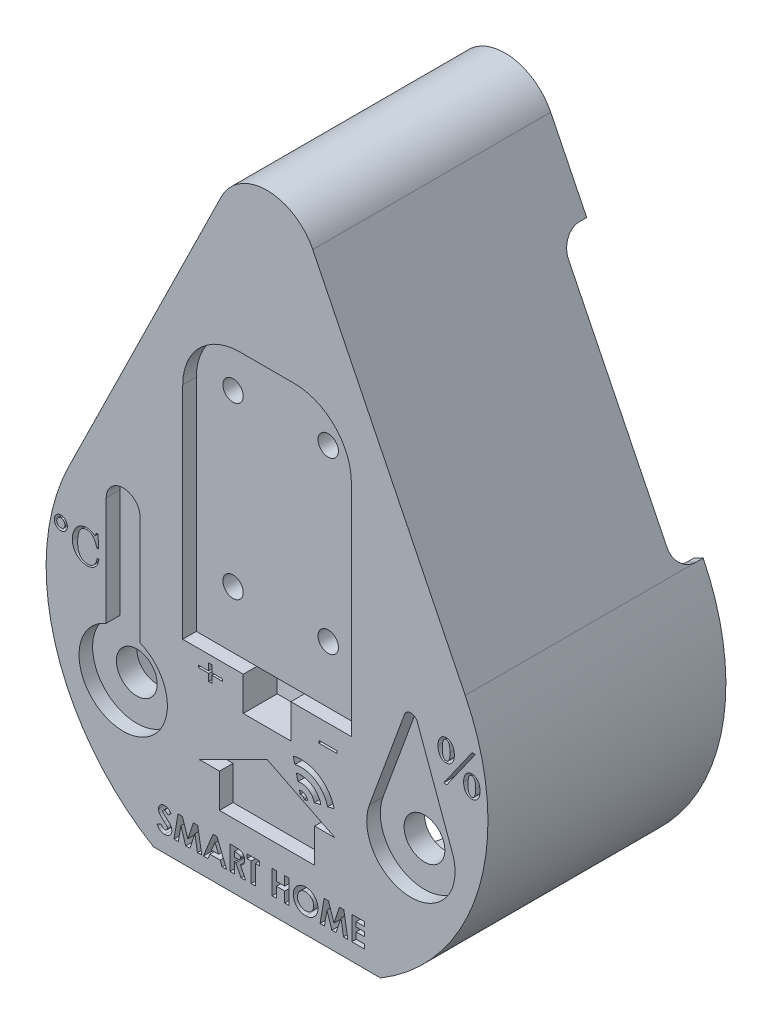
from build123d import *

# Parameters (mm, degrees)
BOSS_EXTRU_1_DEPTH       = 35
COQUE1_T                 = -1.5
COQUE1_THICKNESS_2_DEPTH = 3.5
ESQUISSE3_W              = 4
ESQUISSE3_H              = 38.804985648
ENL_V_MAT_EXTRU_1_DEPTH  = 15
CONG_1_R                 = 3
ESQUISSE4_R              = 1.35
BOSS_EXTRU_2_DEPTH       = 30
ENL_V_MAT_EXTRU_2_REACH  = 105.659
ESQUISSE5_W              = 10
ESQUISSE5_H              = 17
CONG_2_R                 = 3
ESQUISSE6_W              = 2.647435897
ESQUISSE6_H              = 0.358974359
ENL_V_MAT_EXTRU_3_DEPTH  = 2
ENL_V_MAT_EXTRU_4_REACH  = 81.956
ESQUISSE7_W              = 7
ESQUISSE7_H              = 5
ENL_V_MAT_EXTRU_5_REACH  = 81.956
ESQUISSE8_R              = 1.5
ENL_V_MAT_EXTRU_6_REACH  = 81.956
ESQUISSE9_R              = 3
ENL_V_MAT_EXTRU_7_DEPTH  = 2
ENL_V_MAT_EXTRU_10_REACH = 105.659


with BuildPart() as part:
    # Esquisse2 → Boss.-Extru.1 (new body)
    with BuildSketch(Plane.XY):
        with BuildLine():
            Line((-29.160704234, 14.349331991), (-6.729393285, 59.934229225))
            ThreePointArc((-6.729393285, 59.934229225), (0, 64.122844919), (6.729393285, 59.934229225))
            Line((6.729393285, 59.934229225), (29.160704234, 14.349331991))
            ThreePointArc((29.160704234, 14.349331991), (31.172488186, -9.193801187), (16.706711962, -27.877155081))
            Line((16.706711962, -27.877155081), (-16.706711962, -27.877155081))
            ThreePointArc((-16.706711962, -27.877155081), (-31.172488186, -9.193801187), (-29.160704234, 14.349331991))
        make_face()
    extrude(amount=-BOSS_EXTRU_1_DEPTH)

    # Coque1
    coque1_openings = [part.faces().sort_by_distance(p)[0] for p in [
        (0, 10.178570353, -35),
    ]]
    offset(amount=COQUE1_T, openings=coque1_openings, kind=Kind.INTERSECTION)

    # Coque1 thickness 2 face (on inner face of the shell) → Coque1 thickness 2 (add)
    with BuildSketch(Plane(origin=(0, 9.965110244, -1.5), x_dir=(1, 0, 0), z_dir=(0, 0, 1))):
        with BuildLine():
            Line((-27.814825577, 3.721944886), (-5.383514628, 49.30684212))
            ThreePointArc((-5.383514628, 49.30684212), (0, 52.657734675), (5.383514628, 49.30684212))
            Line((5.383514628, 49.30684212), (27.814825577, 3.721944886))
            ThreePointArc((27.814825577, 3.721944886), (29.791173036, -18.537508341), (16.286365151, -36.342265325))
            Line((16.286365151, -36.342265325), (-16.286365151, -36.342265325))
            ThreePointArc((-16.286365151, -36.342265325), (-29.791173036, -18.537508341), (-27.814825577, 3.721944886))
        make_face()
    extrude(amount=-COQUE1_THICKNESS_2_DEPTH)

    # Esquisse3 → Enlèv. mat.-Extru.1 (cut)
    with BuildSketch(Plane(origin=(-29.160704234, 14.349331991, 0), x_dir=(0, 0, 1), z_dir=(-0.8972524379686572, 0.4415179074050126, 0))):
        with Locations((-33, 19.402492824)):
            Rectangle(ESQUISSE3_W, ESQUISSE3_H)
    enl_v_mat_extru_1 = extrude(amount=-ENL_V_MAT_EXTRU_1_DEPTH, mode=Mode.SUBTRACT)

    # Symétrie1: Enlèv. mat.-Extru.1 across plane
    add(enl_v_mat_extru_1.mirror(Plane(origin=(0, 0, 0), x_dir=(0, 0, 1), z_dir=(1, 0, 0))), mode=Mode.SUBTRACT)

    # Congé1
    cong_1_edges = [part.edges().sort_by_distance(p)[0] for p in [
        (-11.354668845, 48.836061538, -31),
        (-28.487764906, 14.01819356, -31),
        (11.354668845, 48.836061538, -31),
        (28.487764906, 14.01819356, -31),
    ]]
    fillet(cong_1_edges, radius=CONG_1_R)

    # Esquisse4 → Boss.-Extru.2 (add)
    with BuildSketch(Plane.XY):
        with Locations((-8, 40.622844919)):
            Circle(ESQUISSE4_R)
        with Locations((8, 40.622844919)):
            Circle(ESQUISSE4_R)
        with Locations((26, 3.622844919)):
            Circle(ESQUISSE4_R)
        with Locations((-26, 3.622844919)):
            Circle(ESQUISSE4_R)
    extrude(amount=-BOSS_EXTRU_2_DEPTH)

    # Esquisse5 → Enlèv. mat.-Extru.2 (cut, up to next)
    with BuildSketch(Plane.XZ.offset(27.877155081), mode=Mode.PRIVATE) as enl_v_mat_extru_2_sk1:
        with Locations((0, -26.5)):
            Rectangle(ESQUISSE5_W, ESQUISSE5_H)
    enl_v_mat_extru_2_tool1 = extrude(enl_v_mat_extru_2_sk1.sketch, amount=-ENL_V_MAT_EXTRU_2_REACH, mode=Mode.PRIVATE) & part.part
    add(enl_v_mat_extru_2_tool1.solids().sort_by_distance((0, -27.877155, -26.5))[0], mode=Mode.SUBTRACT)

    # Congé2
    cong_2_edges = [part.edges().sort_by_distance(p)[0] for p in [
        (5, -27.127155081, -18),
        (-5, -27.127155081, -18),
    ]]
    fillet(cong_2_edges, radius=CONG_2_R)

    # Esquisse6 → Enlèv. mat.-Extru.3 (cut)
    with BuildSketch(Plane.XY):
        with BuildLine():
            Line((-12.4, 33.122844919), (-12.4, 0.722844919))
            Line((-12.4, 0.722844919), (12.4, 0.722844919))
            Line((12.4, 0.722844919), (12.4, 33.122844919))
            ThreePointArc((12.4, 33.122844919), (9.939696962, 39.062541881), (4, 41.522844919))
            Line((4, 41.522844919), (-4, 41.522844919))
            ThreePointArc((-4, 41.522844919), (-9.939696962, 39.062541881), (-12.4, 33.122844919))
        make_face()
        Polygon((-8.587694133, -1.405888912), (-8.587694133, -0.37383763), (-8.094104389, -0.37383763), (-8.094104389, -1.405888912), (-6.568463364, -1.405888912), (-6.568463364, -1.719991476), (-8.094104389, -1.719991476), (-8.094104389, -2.752042758), (-8.587694133, -2.752042758), (-8.587694133, -1.719991476), (-10.113335159, -1.719991476), (-10.113335159, -1.405888912), align=None)
        with Locations((8.932984253, -2.315930272)):
            Rectangle(ESQUISSE6_W, ESQUISSE6_H)
    extrude(amount=-ENL_V_MAT_EXTRU_3_DEPTH, mode=Mode.SUBTRACT)

    # Esquisse7 → Enlèv. mat.-Extru.4 (cut, up to next)
    with BuildSketch(Plane.XY, mode=Mode.PRIVATE) as enl_v_mat_extru_4_sk1:
        with Locations((0, -1.777155081)):
            Rectangle(ESQUISSE7_W, ESQUISSE7_H)
    enl_v_mat_extru_4_tool1 = extrude(enl_v_mat_extru_4_sk1.sketch, amount=-ENL_V_MAT_EXTRU_4_REACH, mode=Mode.PRIVATE) & part.part
    add(enl_v_mat_extru_4_tool1.solids().sort_by_distance((0, -1.777155, 0))[0], mode=Mode.SUBTRACT)

    # Esquisse8 → Enlèv. mat.-Extru.5 (cut, up to next)
    with BuildSketch(Plane.XY, mode=Mode.PRIVATE) as enl_v_mat_extru_5_sk1:
        with Locations((7, 34.122844919)):
            Circle(ESQUISSE8_R)
    enl_v_mat_extru_5_tool1 = extrude(enl_v_mat_extru_5_sk1.sketch, amount=-ENL_V_MAT_EXTRU_5_REACH, mode=Mode.PRIVATE) & part.part
    # Esquisse8 → Enlèv. mat.-Extru.5 (cut, up to next)
    with BuildSketch(Plane.XY, mode=Mode.PRIVATE) as enl_v_mat_extru_5_sk2:
        with Locations((-7, 34.122844919)):
            Circle(ESQUISSE8_R)
    enl_v_mat_extru_5_tool2 = extrude(enl_v_mat_extru_5_sk2.sketch, amount=-ENL_V_MAT_EXTRU_5_REACH, mode=Mode.PRIVATE) & part.part
    # Esquisse8 → Enlèv. mat.-Extru.5 (cut, up to next)
    with BuildSketch(Plane.XY, mode=Mode.PRIVATE) as enl_v_mat_extru_5_sk3:
        with Locations((-7, 9.122844919)):
            Circle(ESQUISSE8_R)
    enl_v_mat_extru_5_tool3 = extrude(enl_v_mat_extru_5_sk3.sketch, amount=-ENL_V_MAT_EXTRU_5_REACH, mode=Mode.PRIVATE) & part.part
    # Esquisse8 → Enlèv. mat.-Extru.5 (cut, up to next)
    with BuildSketch(Plane.XY, mode=Mode.PRIVATE) as enl_v_mat_extru_5_sk4:
        with Locations((7, 9.122844919)):
            Circle(ESQUISSE8_R)
    enl_v_mat_extru_5_tool4 = extrude(enl_v_mat_extru_5_sk4.sketch, amount=-ENL_V_MAT_EXTRU_5_REACH, mode=Mode.PRIVATE) & part.part
    add(enl_v_mat_extru_5_tool1.solids().sort_by_distance((7, 34.122845, 0))[0], mode=Mode.SUBTRACT)
    add(enl_v_mat_extru_5_tool2.solids().sort_by_distance((-7, 34.122845, 0))[0], mode=Mode.SUBTRACT)
    add(enl_v_mat_extru_5_tool3.solids().sort_by_distance((-7, 9.122845, 0))[0], mode=Mode.SUBTRACT)
    add(enl_v_mat_extru_5_tool4.solids().sort_by_distance((7, 9.122845, 0))[0], mode=Mode.SUBTRACT)

    # Esquisse9 → Enlèv. mat.-Extru.6 (cut, up to next)
    with BuildSketch(Plane.XY, mode=Mode.PRIVATE) as enl_v_mat_extru_6_sk1:
        with Locations((-21.160704234, -8.877155081)):
            Circle(ESQUISSE9_R)
    enl_v_mat_extru_6_tool1 = extrude(enl_v_mat_extru_6_sk1.sketch, amount=-ENL_V_MAT_EXTRU_6_REACH, mode=Mode.PRIVATE) & part.part
    # Esquisse9 → Enlèv. mat.-Extru.6 (cut, up to next)
    with BuildSketch(Plane.XY, mode=Mode.PRIVATE) as enl_v_mat_extru_6_sk2:
        with Locations((21.160704234, -8.877155081)):
            Circle(ESQUISSE9_R)
    enl_v_mat_extru_6_tool2 = extrude(enl_v_mat_extru_6_sk2.sketch, amount=-ENL_V_MAT_EXTRU_6_REACH, mode=Mode.PRIVATE) & part.part
    add(enl_v_mat_extru_6_tool1.solids().sort_by_distance((-21.160704, -8.877155, 0))[0], mode=Mode.SUBTRACT)
    add(enl_v_mat_extru_6_tool2.solids().sort_by_distance((21.160704, -8.877155, 0))[0], mode=Mode.SUBTRACT)

    # Esquisse10 → Enlèv. mat.-Extru.7 (cut)
    # profile 1 of 20: a face of its own
    with BuildSketch(Plane.XY):
        with BuildLine():
            Line((15.056806433, -6.642780081), (20.221643034, 7.466594919))
            ThreePointArc((20.221643034, 7.466594919), (21.160704234, 8.122844919), (22.099765434, 7.466594919))
            Line((22.099765434, 7.466594919), (27.264602035, -6.642780081))
            ThreePointArc((27.264602035, -6.642780081), (21.160704234, -15.377155081), (15.056806433, -6.642780081))
        make_face()
    # profile 2 of 20: a face of its own
    with BuildSketch(Plane.XY):
        with BuildLine():
            Line((-23.660704234, -2.877155081), (-23.660704234, 13.122844919))
            ThreePointArc((-23.660704234, 13.122844919), (-21.160704234, 15.622844919), (-18.660704234, 13.122844919))
            Line((-18.660704234, 13.122844919), (-18.660704234, -2.877155081))
            ThreePointArc((-18.660704234, -2.877155081), (-21.160704234, -15.377155081), (-23.660704234, -2.877155081))
        make_face()
    # profile 3 of 20: a face of its own
    with BuildSketch(Plane.XY):
        Polygon((-7, -18.377155081), (7, -18.377155081), (7, -13.377155081), (10, -13.377155081), (0, -8.377155081), (-10, -13.377155081), (-7, -13.377155081), align=None)
    # profile 4 of 20: a face of its own
    with BuildSketch(Plane.XY):
        with BuildLine():
            Line((5.486808155, -10.76305942), (5.973616311, -10.648963758))
            ThreePointArc((5.973616311, -10.648963758), (5.527095064, -10.027348754), (4.771808677, -9.90353877))
            Line((4.771808677, -9.90353877), (4.885904339, -10.390346926))
            ThreePointArc((4.885904339, -10.390346926), (5.263547532, -10.452251917), (5.486808155, -10.76305942))
        make_face()
    # profile 5 of 20: a face of its own
    with BuildSketch(Plane.XY):
        with BuildLine():
            Line((8.894465242, -9.96438979), (9.868081553, -9.736198467))
            ThreePointArc((9.868081553, -9.736198467), (7.635475319, -6.628123445), (3.859043386, -6.009073528))
            Line((3.859043386, -6.009073528), (4.087234709, -6.982689839))
            ThreePointArc((4.087234709, -6.982689839), (7.108380255, -7.477929772), (8.894465242, -9.96438979))
        make_face()
    # profile 6 of 20: a face of its own
    with BuildSketch(Plane.XY):
        with BuildLine():
            Line((6.947232621, -10.420772435), (7.920848932, -10.192581113))
            ThreePointArc((7.920848932, -10.192581113), (6.581285191, -8.327736099), (4.315426032, -7.956306149))
            Line((4.315426032, -7.956306149), (4.543617354, -8.92992246))
            ThreePointArc((4.543617354, -8.92992246), (6.054190127, -9.177542426), (6.947232621, -10.420772435))
        make_face()
    # profile 7 of 20: a face of its own
    with BuildSketch(Plane.XY):
        with BuildLine():
            add(Edge.make_bspline(
                [(26.338015223, 7.568761719), (26.382041334, 7.567729282), (26.46806881, 7.565711889), (26.594025443, 7.544744469), (26.713828192, 7.511117245), (26.827134044, 7.463144724), (26.934067757, 7.401904285), (27.034973721, 7.327563899), (27.128988723, 7.238860645), (27.217300383, 7.138573055), (27.295880827, 7.025416855), (27.365445993, 6.901487278), (27.424317162, 6.766945533), (27.472236566, 6.621522492), (27.507966856, 6.465457402), (27.534130222, 6.298929805), (27.550949893, 6.12196543), (27.552511549, 6.000297602), (27.553312407, 5.937903205)],
                knots=[0, 0, 0, 0, 0.92474221, 1.80695585, 2.675778068, 3.535196686, 4.386290565, 5.260750653, 6.163257686, 7.098402274, 8.064842918, 9.053450699, 10.081545344, 11.147011838, 12.267287243, 13.443107811, 14.688759815, 16, 16, 16, 16], degree=3))
            add(Edge.make_bspline(
                [(27.553312407, 5.937903205), (27.552529332, 5.877596641), (27.551003601, 5.760096322), (27.53393796, 5.589025376), (27.508362261, 5.427697492), (27.47072819, 5.276415083), (27.421970737, 5.135621793), (27.362269997, 5.005132078), (27.293521278, 4.883816513), (27.213411782, 4.773547988), (27.124081139, 4.675976622), (27.029592272, 4.590168576), (26.930539552, 4.515828168), (26.823152446, 4.458509789), (26.71137638, 4.410881682), (26.592562047, 4.379136942), (26.468933451, 4.357838974), (26.384560027, 4.355790991), (26.34178164, 4.354752638)],
                knots=[0, 0, 0, 0, 1.294034017, 2.521274608, 3.686455222, 4.79757641, 5.862909905, 6.879921367, 7.873778966, 8.851222246, 9.798692804, 10.708095967, 11.588464272, 12.448759941, 13.314571882, 14.190667755, 15.082645813, 16, 16, 16, 16], degree=3))
            add(Edge.make_bspline(
                [(26.34178164, 4.354752638), (26.299431538, 4.355812597), (26.216322541, 4.357892689), (26.094473674, 4.378669966), (25.97837051, 4.412858876), (25.867510696, 4.459391731), (25.761589735, 4.518872917), (25.662756149, 4.59395738), (25.568226486, 4.680653535), (25.480244165, 4.780306655), (25.400103011, 4.891370699), (25.330848954, 5.013957791), (25.272921348, 5.147066172), (25.225888727, 5.290115348), (25.187481412, 5.443130818), (25.162343713, 5.606220028), (25.145042685, 5.779341481), (25.143565937, 5.898100265), (25.142805596, 5.959246234)],
                knots=[0, 0, 0, 0, 0.905322101, 1.77662884, 2.635007394, 3.489642864, 4.34357468, 5.226304985, 6.138682109, 7.083639694, 8.065044678, 9.063332239, 10.089608861, 11.165414522, 12.281480087, 13.460408128, 14.692426784, 16, 16, 16, 16], degree=3))
            add(Edge.make_bspline(
                [(25.142805596, 5.959246234), (25.143641819, 6.018709101), (25.145276405, 6.134942552), (25.161729959, 6.304504232), (25.189421807, 6.464731585), (25.22711579, 6.615813061), (25.274170189, 6.758850033), (25.334805189, 6.89177238), (25.405532822, 7.015652154), (25.485392024, 7.129971855), (25.574213457, 7.231689113), (25.667256231, 7.322588633), (25.767386753, 7.397856219), (25.87117071, 7.461289691), (25.980927529, 7.509937624), (26.095502203, 7.542903087), (26.214887781, 7.56610519), (26.296469617, 7.567865354), (26.338015223, 7.568761719)],
                knots=[0, 0, 0, 0, 1.276423331, 2.495054392, 3.653186722, 4.764610971, 5.835826922, 6.88137374, 7.895562672, 8.895198581, 9.869806909, 10.791274552, 11.68263584, 12.553286277, 13.398098687, 14.250995612, 15.109318293, 16, 16, 16, 16], degree=3))
        make_face()
        with BuildLine():
            add(Edge.make_bspline(
                [(26.351825419, 7.327711038), (26.33126799, 7.326566738), (26.29102647, 7.324326749), (26.231788838, 7.311883701), (26.176192254, 7.28850191), (26.123073738, 7.257151921), (26.073708555, 7.215958048), (26.027073264, 7.166558864), (25.983247948, 7.108259588), (25.940945145, 7.040811615), (25.902629014, 6.96080452), (25.87264041, 6.865394112), (25.844343739, 6.756247276), (25.824347113, 6.630876403), (25.806406871, 6.490254448), (25.794527882, 6.333960352), (25.786847003, 6.162292618), (25.786032868, 6.042954043), (25.785607412, 5.980589263)],
                knots=[0, 0, 0, 0, 0.614760439, 1.203404092, 1.797862955, 2.409052142, 3.039880895, 3.712108756, 4.434888254, 5.215596029, 6.088140306, 7.076710691, 8.198849122, 9.454917177, 10.866324287, 12.434385145, 14.136656272, 16, 16, 16, 16], degree=3))
            add(Edge.make_bspline(
                [(25.785607412, 5.980589263), (25.785995309, 5.916547551), (25.786740971, 5.793438643), (25.794962319, 5.616825677), (25.804751509, 5.455805677), (25.823336187, 5.311090736), (25.842997662, 5.181522762), (25.871195398, 5.06855103), (25.901401265, 4.970904727), (25.938529323, 4.889172006), (25.979298758, 4.819919942), (26.023451171, 4.761275137), (26.068648408, 4.709737034), (26.117554968, 4.668034963), (26.169842777, 4.63616594), (26.224415174, 4.613294691), (26.281624913, 4.598878315), (26.320774477, 4.596834475), (26.340526168, 4.595803319)],
                knots=[0, 0, 0, 0, 1.881829036, 3.617484799, 5.19557746, 6.620345193, 7.90422697, 9.043680156, 10.039325923, 10.903464108, 11.6754329, 12.396128346, 13.057965146, 13.686272129, 14.276855595, 14.850155007, 15.4198816, 16, 16, 16, 16], degree=3))
            add(Edge.make_bspline(
                [(26.340526168, 4.595803319), (26.361088993, 4.596939135), (26.401341077, 4.599162514), (26.460501808, 4.611726468), (26.516595609, 4.634727217), (26.568996549, 4.668226957), (26.619884547, 4.708271938), (26.666843942, 4.758434582), (26.710326927, 4.817822197), (26.752417745, 4.886219591), (26.790731227, 4.966687034), (26.822522135, 5.061225103), (26.850079033, 5.169938368), (26.871976955, 5.292501964), (26.889631466, 5.429500659), (26.901633587, 5.580753175), (26.909228836, 5.746574767), (26.910072225, 5.861728813), (26.910510591, 5.921582065)],
                knots=[0, 0, 0, 0, 0.622772356, 1.219087557, 1.821293755, 2.447022224, 3.095914967, 3.776903695, 4.51922367, 5.320887449, 6.204803233, 7.210334875, 8.334821025, 9.597002744, 10.976539723, 12.514533133, 14.188369971, 16, 16, 16, 16], degree=3))
            add(Edge.make_bspline(
                [(26.910510591, 5.921582065), (26.910111962, 5.987296311), (26.909344888, 6.113749066), (26.901277296, 6.294562705), (26.891167965, 6.459299489), (26.873204423, 6.606641267), (26.852347162, 6.738344427), (26.827010998, 6.853195589), (26.795455506, 6.951539069), (26.759428746, 7.034256089), (26.717265942, 7.103100066), (26.67626049, 7.164246747), (26.628133769, 7.213264536), (26.579996155, 7.25571278), (26.526884169, 7.287212598), (26.472161979, 7.31218589), (26.412587747, 7.324239117), (26.372370465, 7.326537107), (26.351825419, 7.327711038)],
                knots=[0, 0, 0, 0, 1.900624469, 3.657337902, 5.234742344, 6.67313937, 7.948757579, 9.091052879, 10.07102709, 10.93260394, 11.692421872, 12.404453816, 13.055198081, 13.673615455, 14.254903083, 14.835055259, 15.404886567, 16, 16, 16, 16], degree=3))
        make_face(mode=Mode.SUBTRACT)
    # profile 8 of 20: a face of its own
    with BuildSketch(Plane.XY):
        Polygon((30.169716675, 7.568761719), (30.641774259, 7.568761719), (26.458540564, 1.622844919), (25.98648298, 1.622844919), align=None)
    # profile 9 of 20: a face of its own
    with BuildSketch(Plane.XY):
        with BuildLine():
            add(Edge.make_bspline(
                [(30.114475894, 4.836854), (30.158502005, 4.835821563), (30.244529481, 4.83380417), (30.370486114, 4.81283675), (30.490288862, 4.779209526), (30.603594714, 4.731237005), (30.710528428, 4.669996566), (30.811434392, 4.59565618), (30.905449393, 4.506952926), (30.993761053, 4.406665336), (31.072341497, 4.293509136), (31.141906663, 4.169579559), (31.200777832, 4.035037814), (31.248697237, 3.889614773), (31.284427526, 3.733549683), (31.310590893, 3.567022085), (31.327410563, 3.390057711), (31.32897222, 3.268389883), (31.329773077, 3.205995486)],
                knots=[0, 0, 0, 0, 0.92474221, 1.80695585, 2.675778068, 3.535196686, 4.386290565, 5.260750653, 6.163257686, 7.098402274, 8.064842918, 9.053450699, 10.081545344, 11.147011838, 12.267287243, 13.443107811, 14.688759815, 16, 16, 16, 16], degree=3))
            add(Edge.make_bspline(
                [(31.329773077, 3.205995486), (31.328971572, 3.146108701), (31.32740462, 3.02902941), (31.310508321, 2.858776202), (31.284725529, 2.6978887), (31.247115095, 2.547604284), (31.199429622, 2.406617815), (31.140225073, 2.276054091), (31.071351764, 2.15430974), (30.990617269, 2.044565217), (30.903518105, 1.944963475), (30.808504937, 1.859516393), (30.709173237, 1.785400944), (30.602502109, 1.726315536), (30.490643015, 1.679324652), (30.372441193, 1.647001981), (30.249147347, 1.625972699), (30.164782676, 1.623897215), (30.122008727, 1.622844919)],
                knots=[0, 0, 0, 0, 1.287042257, 2.516181059, 3.674286724, 4.787126518, 5.842667354, 6.869443565, 7.864838395, 8.843793517, 9.793411693, 10.704221459, 11.585951457, 12.451935009, 13.319086128, 14.187869204, 15.081226912, 16, 16, 16, 16], degree=3))
            add(Edge.make_bspline(
                [(30.122008727, 1.622844919), (30.079242602, 1.6239133), (29.995306607, 1.626010186), (29.872586505, 1.6466058), (29.756057847, 1.680910138), (29.645005281, 1.727828566), (29.538236175, 1.786556045), (29.439245729, 1.862102127), (29.344681448, 1.948732057), (29.256696811, 2.048398727), (29.176603713, 2.15947915), (29.106963823, 2.282318198), (29.049713654, 2.416136353), (29.002074164, 2.559803344), (28.964152338, 2.713370037), (28.938668374, 2.877221701), (28.921532094, 3.05120791), (28.92003628, 3.170797993), (28.919266267, 3.232360404)],
                knots=[0, 0, 0, 0, 0.910829163, 1.78766143, 2.642815218, 3.494239985, 4.352736044, 5.232150099, 6.141099594, 7.082507153, 8.060225184, 9.054762368, 10.085359088, 11.15712315, 12.277654806, 13.452153837, 14.688423424, 16, 16, 16, 16], degree=3))
            add(Edge.make_bspline(
                [(28.919266267, 3.232360404), (28.920105682, 3.291404123), (28.921746263, 3.406801083), (28.938148447, 3.575124534), (28.966083439, 3.734454533), (29.003310275, 3.884830774), (29.050923141, 4.027261645), (29.111233065, 4.159875489), (29.182002036, 4.283741614), (29.261850478, 4.398064868), (29.35067468, 4.499781212), (29.443716762, 4.59068096), (29.543847459, 4.665948488), (29.647631372, 4.729381975), (29.757388202, 4.778029904), (29.871962873, 4.810995368), (29.991348452, 4.834197471), (30.072930287, 4.835957635), (30.114475894, 4.836854)],
                knots=[0, 0, 0, 0, 1.270243319, 2.482604793, 3.6344252, 4.748306299, 5.813358591, 6.861216635, 7.877647474, 8.879493119, 9.85625586, 10.779760446, 11.673092125, 12.545667172, 13.392347075, 14.247129364, 15.107349404, 16, 16, 16, 16], degree=3))
        make_face()
        with BuildLine():
            add(Edge.make_bspline(
                [(30.128286089, 4.595803319), (30.10772866, 4.594659018), (30.067487141, 4.59241903), (30.008249508, 4.579975983), (29.952652928, 4.55659419), (29.899534394, 4.525244205), (29.850169284, 4.484050315), (29.803533694, 4.434651205), (29.759709623, 4.376351616), (29.717401541, 4.308904972), (29.679108711, 4.228892012), (29.648892792, 4.133120287), (29.621003666, 4.023451643), (29.600764924, 3.89772387), (29.582881034, 3.757087901), (29.570984449, 3.600798182), (29.563308851, 3.429129133), (29.562493943, 3.309790751), (29.562068083, 3.247426072)],
                knots=[0, 0, 0, 0, 0.614294839, 1.202492671, 1.79650131, 2.407227601, 3.037578584, 3.709297322, 4.431529409, 5.2116459, 6.083529339, 7.071351012, 8.20475747, 9.459874217, 10.870212372, 12.437085631, 14.13806751, 16, 16, 16, 16], degree=3))
            add(Edge.make_bspline(
                [(29.562068083, 3.247426072), (29.562450215, 3.182965732), (29.563182508, 3.059438078), (29.571422898, 2.882406985), (29.581212249, 2.721387055), (29.599796684, 2.57667195), (29.619458871, 2.447104484), (29.647654396, 2.334131171), (29.67786703, 2.236489707), (29.714974407, 2.154742196), (29.755809546, 2.085537121), (29.799558499, 2.026984405), (29.845063738, 1.976371758), (29.894784235, 1.936366673), (29.945896332, 1.902852241), (30.000746084, 1.879826772), (30.058261022, 1.867350132), (30.097262117, 1.865055902), (30.116986838, 1.8638956)],
                knots=[0, 0, 0, 0, 1.894240674, 3.630001079, 5.208188883, 6.633042515, 7.917001696, 9.05652358, 10.052229373, 10.916419657, 11.688434991, 12.409173888, 13.0619605, 13.682431816, 14.279546301, 14.852880276, 15.419846625, 16, 16, 16, 16], degree=3))
            add(Edge.make_bspline(
                [(30.116986838, 1.8638956), (30.13754565, 1.865038285), (30.177789877, 1.86727511), (30.237007799, 1.879741183), (30.292680014, 1.903034625), (30.345783822, 1.934895943), (30.396774295, 1.975176176), (30.44246309, 2.026390297), (30.487280241, 2.084694217), (30.528804318, 2.153125348), (30.566941078, 2.233180227), (30.599247832, 2.327136479), (30.626474998, 2.435538062), (30.648579908, 2.558480438), (30.665900633, 2.695522891), (30.67818398, 2.846744065), (30.685669405, 3.012158141), (30.686526021, 3.127310846), (30.686971261, 3.187163402)],
                knots=[0, 0, 0, 0, 0.623531141, 1.22057289, 1.823512814, 2.443421752, 3.093105104, 3.784179689, 4.51727098, 5.319911505, 6.204904249, 7.199686405, 8.325542625, 9.589262183, 10.983058639, 12.51028645, 14.186162686, 16, 16, 16, 16], degree=3))
            add(Edge.make_bspline(
                [(30.686971261, 3.187163402), (30.686594651, 3.253297245), (30.68587453, 3.379752437), (30.677578274, 3.561388497), (30.667794242, 3.726570027), (30.64959729, 3.874718218), (30.62905308, 4.006079739), (30.603014408, 4.120738945), (30.572195785, 4.219301977), (30.535863074, 4.302340264), (30.493732845, 4.371194265), (30.452719689, 4.432338575), (30.404594799, 4.481356928), (30.356456738, 4.523805034), (30.303344862, 4.555304887), (30.248622643, 4.580278169), (30.189048419, 4.592331399), (30.148831136, 4.594629388), (30.128286089, 4.595803319)],
                knots=[0, 0, 0, 0, 1.909877372, 3.65189587, 5.251065976, 6.687318993, 7.961035821, 9.089847896, 10.079864553, 10.940157174, 11.698842556, 12.409813177, 13.059587472, 13.67708306, 14.257504247, 14.836791674, 15.405773616, 16, 16, 16, 16], degree=3))
        make_face(mode=Mode.SUBTRACT)
    # profile 10 of 20: a face of its own
    with BuildSketch(Plane.XY):
        with BuildLine():
            add(Edge.make_bspline(
                [(-30.33304228, 7.582282519), (-30.300369229, 7.581282804), (-30.236009994, 7.57931357), (-30.141052517, 7.566554111), (-30.050467277, 7.541773154), (-29.962164863, 7.511975844), (-29.879075909, 7.469044689), (-29.798535304, 7.41978223), (-29.722837236, 7.359263087), (-29.651338234, 7.291522731), (-29.585783992, 7.217505522), (-29.527514021, 7.139247258), (-29.479901604, 7.056004954), (-29.439878386, 6.969794745), (-29.408444702, 6.880011534), (-29.387048613, 6.785863828), (-29.373568662, 6.688147707), (-29.371677872, 6.621576197), (-29.370722764, 6.58794846)],
                knots=[0, 0, 0, 0, 1.019400033, 2.008009772, 2.979256541, 3.945407205, 4.908676351, 5.889400839, 6.886362387, 7.925183083, 8.958591652, 9.967072519, 10.962879619, 11.944141531, 12.928767863, 13.923852753, 14.95126106, 16, 16, 16, 16], degree=3))
            add(Edge.make_bspline(
                [(-29.370722764, 6.58794846), (-29.371676626, 6.554320101), (-29.373564951, 6.487747363), (-29.387062915, 6.390040223), (-29.408393146, 6.295859678), (-29.440163733, 6.205927553), (-29.479324528, 6.11926845), (-29.528136953, 6.036420337), (-29.585449979, 5.957542445), (-29.651076606, 5.883447979), (-29.723149575, 5.816652172), (-29.798507194, 5.756102305), (-29.879049629, 5.706755946), (-29.962389814, 5.664262637), (-30.050099827, 5.63260937), (-30.141242331, 5.609740088), (-30.235980562, 5.596476841), (-30.300359318, 5.594578251), (-30.33304228, 5.5936144)],
                knots=[0, 0, 0, 0, 1.048573106, 2.07581895, 3.070746491, 4.055217125, 5.045220447, 6.032412767, 7.048638606, 8.081883764, 9.113829709, 10.110633611, 11.091203019, 12.054319846, 13.023635197, 13.992307749, 14.980761162, 16, 16, 16, 16], degree=3))
            add(Edge.make_bspline(
                [(-30.33304228, 5.5936144), (-30.366040116, 5.594575018), (-30.431045937, 5.596467438), (-30.526699578, 5.609779999), (-30.618567802, 5.632389768), (-30.706671553, 5.664576275), (-30.790525078, 5.706147896), (-30.870576324, 5.756756493), (-30.946683251, 5.816262542), (-31.018730027, 5.883508116), (-31.084412679, 5.957526603), (-31.141711014, 6.036424418), (-31.190527247, 6.119267366), (-31.22968703, 6.205927842), (-31.261457888, 6.2958596), (-31.282788045, 6.390040244), (-31.296286029, 6.487747357), (-31.298174351, 6.5543201), (-31.299128212, 6.58794846)],
                knots=[0, 0, 0, 0, 1.026632713, 2.022469078, 2.998375091, 3.965444752, 4.935075408, 5.905099463, 6.907285033, 7.936840186, 8.967691542, 9.981563009, 10.966468221, 11.954177922, 12.936367755, 13.928990266, 14.953856208, 16, 16, 16, 16], degree=3))
            add(Edge.make_bspline(
                [(-31.299128212, 6.58794846), (-31.298173106, 6.621576199), (-31.296282318, 6.688147712), (-31.282802347, 6.785863807), (-31.261406332, 6.880011611), (-31.229972379, 6.969794458), (-31.189950163, 7.056006028), (-31.142333935, 7.13924316), (-31.084078527, 7.217521186), (-31.018468399, 7.291462556), (-30.946998128, 7.359655814), (-30.870548571, 7.419128489), (-30.790499264, 7.46965389), (-30.706897632, 7.511665516), (-30.618201621, 7.541992511), (-30.526888397, 7.566516339), (-30.431016575, 7.579322483), (-30.366030229, 7.581285875), (-30.33304228, 7.582282519)],
                knots=[0, 0, 0, 0, 1.046310389, 2.07133954, 3.064120125, 4.046466371, 5.025455987, 6.01895711, 7.025102651, 8.05611817, 9.092533282, 10.094878449, 11.065056979, 12.034842048, 12.998755409, 13.977208846, 14.973203797, 16, 16, 16, 16], degree=3))
        make_face()
        with BuildLine():
            add(Edge.make_bspline(
                [(-30.33304228, 7.220706498), (-30.373491233, 7.218735644), (-30.452848598, 7.214868998), (-30.566925856, 7.178037735), (-30.671100308, 7.118422348), (-30.763614508, 7.037546096), (-30.83999387, 6.940617644), (-30.897369305, 6.832137821), (-30.931192452, 6.712976648), (-30.935401957, 6.630220611), (-30.937552191, 6.58794846)],
                knots=[0, 0, 0, 0, 0.996542889, 1.955131327, 2.927164686, 3.943675932, 4.970274459, 5.95840091, 6.957142114, 8, 8, 8, 8], degree=3))
            add(Edge.make_bspline(
                [(-30.937552191, 6.58794846), (-30.935401957, 6.545676308), (-30.931192452, 6.462920271), (-30.897369305, 6.343759099), (-30.83999387, 6.235279275), (-30.763614508, 6.138350823), (-30.671100308, 6.057474571), (-30.566925856, 5.997859185), (-30.452848598, 5.961027922), (-30.373491233, 5.957161276), (-30.33304228, 5.955190422)],
                knots=[0, 0, 0, 0, 1.042857886, 2.04159909, 3.029725541, 4.056324068, 5.072835314, 6.044868673, 7.003457111, 8, 8, 8, 8], degree=3))
            add(Edge.make_bspline(
                [(-30.33304228, 5.955190422), (-30.292585675, 5.957131172), (-30.213513458, 5.960924358), (-30.100077581, 5.99788906), (-29.99677024, 6.05747215), (-29.905347946, 6.138709359), (-29.828683309, 6.23498056), (-29.77271396, 6.344045225), (-29.738586565, 6.462881667), (-29.73442469, 6.545663256), (-29.732298785, 6.58794846)],
                knots=[0, 0, 0, 0, 0.999482183, 1.95348257, 2.921632906, 3.935286035, 4.964912505, 5.952379233, 6.954066214, 8, 8, 8, 8], degree=3))
            add(Edge.make_bspline(
                [(-29.732298785, 6.58794846), (-29.73442469, 6.630233663), (-29.738586565, 6.713015253), (-29.77271396, 6.831851694), (-29.828683309, 6.940916359), (-29.905347946, 7.03718756), (-29.99677024, 7.118424769), (-30.100077581, 7.17800786), (-30.213513458, 7.214972562), (-30.292585675, 7.218765748), (-30.33304228, 7.220706498)],
                knots=[0, 0, 0, 0, 1.045933786, 2.047620767, 3.035087495, 4.064713965, 5.078367094, 6.04651743, 7.000517817, 8, 8, 8, 8], degree=3))
        make_face(mode=Mode.SUBTRACT)
    # profile 11 of 20: a face of its own
    with BuildSketch(Plane.XY):
        with BuildLine():
            Line((-25.323707813, 7.429742635), (-25.092073174, 7.883595871))
            Line((-25.092073174, 7.883595871), (-24.851022493, 7.883595871))
            Line((-24.851022493, 7.883595871), (-24.790759823, 6.015453092))
            Line((-24.790759823, 6.015453092), (-25.031810504, 6.015453092))
            add(Edge.make_bspline(
                [(-25.031810504, 6.015453092), (-25.049513104, 6.079003834), (-25.083970485, 6.202702735), (-25.142366131, 6.380099827), (-25.203554295, 6.544850139), (-25.268061069, 6.696592121), (-25.337190972, 6.835227163), (-25.407932425, 6.961744233), (-25.483416678, 7.07466367), (-25.538220277, 7.142607987), (-25.564758494, 7.175509495)],
                knots=[0, 0, 0, 0, 1.230655039, 2.395419342, 3.483092244, 4.508801559, 5.469893956, 6.371983475, 7.211645638, 8, 8, 8, 8], degree=3))
            add(Edge.make_bspline(
                [(-25.564758494, 7.175509495), (-25.597930362, 7.212631077), (-25.662979125, 7.285425079), (-25.770757251, 7.380208392), (-25.882710668, 7.461479621), (-25.99976964, 7.527845186), (-26.122244557, 7.578890446), (-26.24909921, 7.615989786), (-26.380986146, 7.638084677), (-26.470499184, 7.641046813), (-26.515778759, 7.64254519)],
                knots=[0, 0, 0, 0, 1.090105817, 2.137655792, 3.137894733, 4.117271914, 5.079127691, 6.039014165, 7.008048343, 8, 8, 8, 8], degree=3))
            add(Edge.make_bspline(
                [(-26.515778759, 7.64254519), (-26.564536656, 7.64092628), (-26.660174672, 7.637750807), (-26.799953126, 7.612435751), (-26.932811921, 7.571891416), (-27.059284667, 7.514987066), (-27.178409571, 7.440948139), (-27.290173141, 7.350360585), (-27.395335329, 7.244230638), (-27.492760883, 7.120609007), (-27.582635407, 6.978348774), (-27.65828185, 6.812825512), (-27.721729999, 6.625203138), (-27.773871949, 6.415378172), (-27.814992312, 6.183530832), (-27.843257771, 5.92908183), (-27.8615174, 5.652261971), (-27.863254317, 5.459938063), (-27.864156007, 5.360096553)],
                knots=[0, 0, 0, 0, 0.785948627, 1.541628582, 2.282998753, 3.021598601, 3.771747976, 4.538603351, 5.336829251, 6.176422591, 7.072516165, 8.044085301, 9.103845025, 10.2628361, 11.527877559, 12.898597512, 14.389962492, 16, 16, 16, 16], degree=3))
            add(Edge.make_bspline(
                [(-27.864156007, 5.360096553), (-27.862975326, 5.275623112), (-27.860680748, 5.111454432), (-27.840568748, 4.873098339), (-27.808623955, 4.650114396), (-27.761099375, 4.443183722), (-27.702310263, 4.251072245), (-27.630056389, 4.074134904), (-27.54366416, 3.912624287), (-27.474424189, 3.81551501), (-27.440434106, 3.767843812)],
                knots=[0, 0, 0, 0, 1.208957664, 2.349531172, 3.421415891, 4.430644946, 5.385583263, 6.294162597, 7.162599961, 8, 8, 8, 8], degree=3))
            add(Edge.make_bspline(
                [(-27.440434106, 3.767843812), (-27.409592373, 3.730646495), (-27.348941113, 3.657496776), (-27.244126713, 3.562502555), (-27.129969133, 3.483258696), (-27.007948352, 3.416337969), (-26.875880751, 3.36533962), (-26.73477774, 3.330121579), (-26.584906911, 3.307830284), (-26.481962028, 3.305056093), (-26.429151171, 3.30363293)],
                knots=[0, 0, 0, 0, 1.00326522, 1.972953305, 2.928408448, 3.885754283, 4.858443318, 5.861454053, 6.902923168, 8, 8, 8, 8], degree=3))
            add(Edge.make_bspline(
                [(-26.429151171, 3.30363293), (-26.38264413, 3.304674968), (-26.291195319, 3.306723973), (-26.15695441, 3.324175455), (-26.028248632, 3.352130146), (-25.905558473, 3.392223893), (-25.787812764, 3.441461231), (-25.677456847, 3.505050788), (-25.571084607, 3.576985529), (-25.472294269, 3.662602916), (-25.37962712, 3.758537337), (-25.295561245, 3.866598958), (-25.220311984, 3.986151919), (-25.152159271, 4.1161952), (-25.093816964, 4.25852293), (-25.044834003, 4.412129581), (-25.001260548, 4.576546182), (-24.9816381, 4.69105449), (-24.971547834, 4.749937016)],
                knots=[0, 0, 0, 0, 0.985343134, 1.937522938, 2.863979946, 3.7727867, 4.669855673, 5.563464862, 6.467609474, 7.387571508, 8.328531206, 9.290628252, 10.283487734, 11.318934952, 12.398652207, 13.538850263, 14.734426204, 16, 16, 16, 16], degree=3))
            Line((-24.971547834, 4.749937016), (-24.730497153, 4.749937016))
            add(Edge.make_bspline(
                [(-24.730497153, 4.749937016), (-24.739501195, 4.683842801), (-24.757070578, 4.554874655), (-24.800200378, 4.369015791), (-24.853376397, 4.194595135), (-24.919653176, 4.032196605), (-24.9967314, 3.880504612), (-25.086453262, 3.740888635), (-25.187458059, 3.612585757), (-25.301033191, 3.498032279), (-25.423083802, 3.39520006), (-25.554095768, 3.306062023), (-25.692559835, 3.2306596), (-25.838972185, 3.169067662), (-25.992777073, 3.120821423), (-26.154934684, 3.087422978), (-26.324369433, 3.065961639), (-26.440070216, 3.063720454), (-26.498829883, 3.062582249)],
                knots=[0, 0, 0, 0, 1.181358664, 2.305158431, 3.376416716, 4.409146717, 5.409009779, 6.387059458, 7.345060589, 8.29674548, 9.240221606, 10.168812371, 11.099548939, 12.029155003, 12.978985676, 13.950817597, 14.959304577, 16, 16, 16, 16], degree=3))
            add(Edge.make_bspline(
                [(-26.498829883, 3.062582249), (-26.547193331, 3.063559494), (-26.643156381, 3.065498551), (-26.785383455, 3.078782707), (-26.924468556, 3.101333945), (-27.060220837, 3.1337077), (-27.193464225, 3.174001453), (-27.323713349, 3.224111799), (-27.450672988, 3.28353327), (-27.574098415, 3.351262925), (-27.692910851, 3.427450234), (-27.805856703, 3.512512662), (-27.913362297, 3.604719117), (-28.014695397, 3.704820161), (-28.108665244, 3.813683114), (-28.197622502, 3.929828946), (-28.28035339, 4.05407071), (-28.356228233, 4.185632492), (-28.425088547, 4.322468035), (-28.483893474, 4.464048096), (-28.535717321, 4.608217606), (-28.575343938, 4.756187842), (-28.607825204, 4.906974364), (-28.631582321, 5.060972376), (-28.644585852, 5.218628706), (-28.646570889, 5.324607324), (-28.64757072, 5.377987033)],
                knots=[0, 0, 0, 0, 0.988288773, 1.960968692, 2.916322137, 3.865345879, 4.81085173, 5.759029765, 6.714576974, 7.673369273, 8.634133339, 9.596245306, 10.56049293, 11.526552149, 12.504041915, 13.49698207, 14.514538985, 15.551975496, 16.598964739, 17.64249038, 18.683173589, 19.727270727, 20.770165385, 21.834226231, 22.909134916, 24, 24, 24, 24], degree=3))
            add(Edge.make_bspline(
                [(-28.64757072, 5.377987033), (-28.646679237, 5.434827952), (-28.644903369, 5.548057228), (-28.630205554, 5.71654343), (-28.607249077, 5.882711414), (-28.572527753, 6.045596747), (-28.530921074, 6.206348499), (-28.477124956, 6.363648507), (-28.4166555, 6.519523123), (-28.344931869, 6.670957859), (-28.266789508, 6.816549455), (-28.182601389, 6.95400079), (-28.093183394, 7.081866859), (-27.999383125, 7.201198034), (-27.898631514, 7.309741942), (-27.793716429, 7.410088106), (-27.681758718, 7.499388677), (-27.566184144, 7.580476349), (-27.446769501, 7.652276693), (-27.323568661, 7.713250937), (-27.199027504, 7.766376585), (-27.07160542, 7.808572198), (-26.942587345, 7.843231655), (-26.810520654, 7.866165275), (-26.676503417, 7.880942565), (-26.586438224, 7.882708774), (-26.541202073, 7.883595871)],
                knots=[0, 0, 0, 0, 1.125979097, 2.24299325, 3.348436683, 4.447283956, 5.540839799, 6.636162292, 7.738961475, 8.851709354, 9.953491179, 11.011478321, 12.043094671, 13.043404836, 14.015980089, 14.974921418, 15.91695849, 16.85025257, 17.770612579, 18.674437829, 19.571822437, 20.450834269, 21.331691843, 22.21605446, 23.103995388, 24, 24, 24, 24], degree=3))
            add(Edge.make_bspline(
                [(-26.541202073, 7.883595871), (-26.490630783, 7.88213306), (-26.389808573, 7.879216707), (-26.239570402, 7.861744565), (-26.092545528, 7.828692787), (-25.945608573, 7.785303134), (-25.796592868, 7.724877696), (-25.643420806, 7.644845313), (-25.483399823, 7.546567189), (-25.378411302, 7.469761611), (-25.323707813, 7.429742635)],
                knots=[0, 0, 0, 0, 0.916527409, 1.827248576, 2.735302077, 3.643943137, 4.60078697, 5.643682074, 6.772258035, 8, 8, 8, 8], degree=3))
        make_face()
    # profile 12 of 20: a face of its own
    with BuildSketch(Plane.XY):
        with BuildLine():
            Line((-14.094570089, -22.344803318), (-14.564321691, -22.774590978))
            add(Edge.make_bspline(
                [(-14.564321691, -22.774590978), (-14.584443836, -22.746206602), (-14.623075547, -22.691712557), (-14.685693521, -22.618743747), (-14.748028743, -22.556495921), (-14.810658711, -22.505229123), (-14.874138553, -22.465254837), (-14.938358076, -22.4369526), (-15.002953204, -22.4189606), (-15.046351158, -22.416720163), (-15.06772714, -22.415616619)],
                knots=[0, 0, 0, 0, 1.299362458, 2.494594718, 3.587462134, 4.587049575, 5.512617175, 6.380583204, 7.202344345, 8, 8, 8, 8], degree=3))
            add(Edge.make_bspline(
                [(-15.06772714, -22.415616619), (-15.087666043, -22.416315875), (-15.126162825, -22.417665955), (-15.181042844, -22.431085644), (-15.229766107, -22.454246056), (-15.272285061, -22.484530243), (-15.305966346, -22.521015668), (-15.33285824, -22.559279498), (-15.348000636, -22.601514112), (-15.349993674, -22.630522549), (-15.350980345, -22.644883446)],
                knots=[0, 0, 0, 0, 1.185010067, 2.2879431, 3.333075148, 4.379039566, 5.372662701, 6.27520591, 7.14612461, 8, 8, 8, 8], degree=3))
            add(Edge.make_bspline(
                [(-15.350980345, -22.644883446), (-15.350362048, -22.659451434), (-15.349116884, -22.688789336), (-15.33709029, -22.731787686), (-15.318962779, -22.773802079), (-15.301641202, -22.799378239), (-15.292787236, -22.812451555)],
                knots=[0, 0, 0, 0, 0.967525499, 1.948461899, 2.951351359, 4, 4, 4, 4], degree=3))
            add(Edge.make_bspline(
                [(-15.292787236, -22.812451555), (-15.284738024, -22.822613307), (-15.266209799, -22.846004317), (-15.23088027, -22.883052031), (-15.186513801, -22.928438724), (-15.131403078, -22.98060368), (-15.067835897, -23.041422955), (-14.992865839, -23.10850572), (-14.908650867, -23.18392945), (-14.848792817, -23.236451805), (-14.817426659, -23.263973991)],
                knots=[0, 0, 0, 0, 0.473873513, 1.090794244, 1.870441696, 2.795289791, 3.865433203, 5.087734844, 6.473946851, 8, 8, 8, 8], degree=3))
            add(Edge.make_bspline(
                [(-14.817426659, -23.263973991), (-14.787985009, -23.289454255), (-14.732110873, -23.337810501), (-14.652613073, -23.406444428), (-14.582747748, -23.468192699), (-14.521497117, -23.522128605), (-14.469789683, -23.568818055), (-14.427408065, -23.608484226), (-14.393834645, -23.64035489), (-14.374750122, -23.65960479), (-14.366605345, -23.667820145)],
                knots=[0, 0, 0, 0, 1.543621617, 2.929473131, 4.163658386, 5.240097082, 6.164993805, 6.925417477, 7.541396219, 8, 8, 8, 8], degree=3))
            add(Edge.make_bspline(
                [(-14.366605345, -23.667820145), (-14.335705761, -23.701260113), (-14.276305908, -23.765543475), (-14.199107039, -23.86516247), (-14.135569873, -23.962410922), (-14.086416316, -24.059118718), (-14.049293573, -24.156681159), (-14.023121548, -24.257490959), (-14.007446948, -24.362601517), (-14.005706701, -24.434326642), (-14.004826499, -24.4706046)],
                knots=[0, 0, 0, 0, 1.206664779, 2.319633467, 3.337109185, 4.282041471, 5.190008762, 6.099243693, 7.03861361, 8, 8, 8, 8], degree=3))
            add(Edge.make_bspline(
                [(-14.004826499, -24.4706046), (-14.005453004, -24.505953022), (-14.006682231, -24.57530794), (-14.021737899, -24.676798532), (-14.043206397, -24.773929434), (-14.076400462, -24.865643723), (-14.116857191, -24.953446863), (-14.167575545, -25.035971158), (-14.227137297, -25.114051789), (-14.29540421, -25.186292969), (-14.370915521, -25.251846833), (-14.45190858, -25.310204431), (-14.539175376, -25.358386061), (-14.631970316, -25.398060197), (-14.730243728, -25.428617747), (-14.83387854, -25.451202624), (-14.943033268, -25.464757712), (-15.017674844, -25.466174735), (-15.05580807, -25.466898671)],
                knots=[0, 0, 0, 0, 1.043214005, 2.046824704, 3.02475056, 3.976699089, 4.921714032, 5.875962561, 6.831408892, 7.817874052, 8.806269674, 9.781291748, 10.760897367, 11.74438705, 12.757449933, 13.795994037, 14.874007457, 16, 16, 16, 16], degree=3))
            add(Edge.make_bspline(
                [(-15.05580807, -25.466898671), (-15.085742327, -25.466367617), (-15.145029325, -25.465315826), (-15.232409397, -25.456728829), (-15.316784733, -25.44287033), (-15.398060294, -25.423006961), (-15.47660224, -25.397837379), (-15.552413796, -25.367093698), (-15.62497161, -25.330299403), (-15.694824689, -25.288211131), (-15.76163346, -25.239341104), (-15.826242695, -25.184688452), (-15.888010633, -25.123412594), (-15.947233933, -25.055658445), (-16.003533668, -24.981234141), (-16.05875273, -24.901176179), (-16.110437017, -24.813998791), (-16.142364701, -24.752843148), (-16.158672653, -24.721606203)],
                knots=[0, 0, 0, 0, 1.016823716, 2.013894106, 2.979844003, 3.91962641, 4.853723003, 5.779685073, 6.695824784, 7.614987388, 8.547259901, 9.504950863, 10.487499108, 11.500346958, 12.559593716, 13.656357062, 14.802919212, 16, 16, 16, 16], degree=3))
            Line((-16.158672653, -24.721606203), (-15.606188679, -24.389975594))
            add(Edge.make_bspline(
                [(-15.606188679, -24.389975594), (-15.585789868, -24.425433608), (-15.546683605, -24.49340965), (-15.480414385, -24.584744079), (-15.412524953, -24.662956899), (-15.341445766, -24.726665693), (-15.268041119, -24.77672233), (-15.191956452, -24.812496275), (-15.113138308, -24.834640307), (-15.059450969, -24.837344605), (-15.03267105, -24.838693542)],
                knots=[0, 0, 0, 0, 1.283663364, 2.460892379, 3.537111102, 4.529833553, 5.449777664, 6.316464042, 7.160231139, 8, 8, 8, 8], degree=3))
            add(Edge.make_bspline(
                [(-15.03267105, -24.838693542), (-15.005432039, -24.837591927), (-14.952584391, -24.835454632), (-14.877151136, -24.815713085), (-14.807991071, -24.784717408), (-14.748209622, -24.74049085), (-14.69759046, -24.689446682), (-14.660230613, -24.63265771), (-14.636760905, -24.571213413), (-14.634279588, -24.528530163), (-14.633031627, -24.507062933)],
                knots=[0, 0, 0, 0, 1.13588714, 2.203786484, 3.234766741, 4.283437687, 5.291419208, 6.222934724, 7.106237994, 8, 8, 8, 8], degree=3))
            add(Edge.make_bspline(
                [(-14.633031627, -24.507062933), (-14.634184068, -24.48709117), (-14.63652514, -24.446520445), (-14.653768756, -24.386198301), (-14.680725787, -24.325903589), (-14.712617855, -24.276448236), (-14.745072029, -24.235040609), (-14.776105539, -24.199162774), (-14.813896144, -24.159524046), (-14.858348025, -24.116074565), (-14.908873856, -24.068431833), (-14.965516199, -24.016600515), (-15.028923668, -23.961037183), (-15.073740193, -23.923187991), (-15.097174256, -23.903397068)],
                knots=[0, 0, 0, 0, 0.916159276, 1.861089862, 2.860218735, 3.940849679, 4.552606315, 5.27541173, 6.11797699, 7.06649574, 8.129236253, 9.306560635, 10.591630461, 12, 12, 12, 12], degree=3))
            add(Edge.make_bspline(
                [(-15.097174256, -23.903397068), (-15.141723342, -23.865704269), (-15.227226523, -23.793360379), (-15.348053365, -23.686510731), (-15.456929169, -23.586649944), (-15.552913566, -23.492543521), (-15.637229545, -23.405929389), (-15.709306082, -23.326104036), (-15.768351384, -23.252451717), (-15.830483833, -23.165215475), (-15.889522082, -23.058912119), (-15.940547882, -22.931016858), (-15.973651268, -22.803137826), (-15.977360042, -22.717286887), (-15.979185473, -22.675031683)],
                knots=[0, 0, 0, 0, 1.345494975, 2.582412109, 3.71882943, 4.751509156, 5.681369928, 6.505683931, 7.230279997, 7.856715994, 8.973648664, 10.023341002, 11.027102913, 12, 12, 12, 12], degree=3))
            add(Edge.make_bspline(
                [(-15.979185473, -22.675031683), (-15.978426279, -22.645066561), (-15.976930584, -22.586032051), (-15.963588757, -22.499230406), (-15.943648888, -22.415474112), (-15.914690473, -22.335068749), (-15.877105947, -22.25811503), (-15.831461001, -22.184236233), (-15.777046854, -22.114112322), (-15.715725784, -22.047789784), (-15.648165664, -21.987178532), (-15.575969091, -21.933683029), (-15.499544703, -21.888499949), (-15.419360026, -21.851017303), (-15.334918189, -21.822326719), (-15.24684127, -21.801989403), (-15.155002941, -21.789893415), (-15.092536491, -21.788249106), (-15.060715922, -21.787411491)],
                knots=[0, 0, 0, 0, 1.010766082, 1.991317756, 2.957454644, 3.913069143, 4.869106762, 5.843196583, 6.838735724, 7.860187025, 8.887984031, 9.89767229, 10.887916223, 11.879572884, 12.879850636, 13.892031539, 14.926195476, 16, 16, 16, 16], degree=3))
            add(Edge.make_bspline(
                [(-15.060715922, -21.787411491), (-15.01947804, -21.788920061), (-14.937327792, -21.791925292), (-14.815866281, -21.815425217), (-14.697227756, -21.852381325), (-14.601626608, -21.896964802), (-14.52555856, -21.940152839), (-14.467259507, -21.979914942), (-14.407937082, -22.025464569), (-14.347112887, -22.076945257), (-14.28591713, -22.135326971), (-14.222609722, -22.199219889), (-14.158053306, -22.269176194), (-14.11610187, -22.319152653), (-14.094570089, -22.344803318)],
                knots=[0, 0, 0, 0, 1.282922637, 2.555718331, 3.837320111, 5.142675274, 5.830281639, 6.55870424, 7.337177975, 8.157850921, 9.037902056, 9.96903443, 10.957596896, 12, 12, 12, 12], degree=3))
        make_face()
    # profile 13 of 20: a face of its own
    with BuildSketch(Plane.XY):
        Polygon((-13.099678262, -21.877155081), (-12.447634993, -21.877155081), (-11.649057268, -24.318461171), (-10.84487057, -21.877155081), (-10.199137397, -21.877155081), (-9.607390602, -25.377155081), (-10.24330807, -25.377155081), (-10.617005986, -23.166518062), (-11.344770409, -25.377155081), (-11.957550858, -25.377155081), (-12.68110855, -23.166518062), (-13.054105345, -25.377155081), (-13.690723935, -25.377155081), align=None)
    # profile 14 of 20: a face of its own
    with BuildSketch(Plane.XY):
        Polygon((-7.94643307, -21.877155081), (-7.363800858, -21.877155081), (-5.95033932, -25.377155081), (-6.621312877, -25.377155081), (-6.893348134, -24.659206363), (-8.418288038, -24.659206363), (-8.690323294, -25.377155081), (-9.36059573, -25.377155081), align=None)
        Polygon((-7.655467525, -22.815957164), (-8.179906627, -24.031001235), (-7.131028422, -24.031001235), align=None, mode=Mode.SUBTRACT)
    # profile 15 of 20: a face of its own
    with BuildSketch(Plane.XY):
        with BuildLine():
            Line((-5.434313679, -21.877155081), (-4.702342525, -21.877155081))
            add(Edge.make_bspline(
                [(-4.702342525, -21.877155081), (-4.653959454, -21.877326813), (-4.560905181, -21.877657102), (-4.426726001, -21.882868192), (-4.303463972, -21.890119851), (-4.190936593, -21.901186075), (-4.089192005, -21.915858551), (-3.998128236, -21.933154972), (-3.917747948, -21.952867951), (-3.847373244, -21.977431879), (-3.783863553, -22.005139618), (-3.724663692, -22.036976317), (-3.668467623, -22.072587466), (-3.615650957, -22.11291009), (-3.565754704, -22.157218795), (-3.518684732, -22.205558182), (-3.475106183, -22.258338149), (-3.435288898, -22.315225194), (-3.398998647, -22.375069061), (-3.366925677, -22.437951915), (-3.340843885, -22.503917489), (-3.317797825, -22.572012436), (-3.301198495, -22.643210187), (-3.289653904, -22.71681762), (-3.281201406, -22.793093841), (-3.280715427, -22.844912519), (-3.280467525, -22.871345786)],
                knots=[0, 0, 0, 0, 1.749336639, 3.364467119, 4.854658419, 6.213483162, 7.451590619, 8.570285859, 9.5643256, 10.440900261, 11.26203566, 12.067320669, 12.869050712, 13.665104639, 14.467235401, 15.27997916, 16.102287765, 16.939272006, 17.78853747, 18.631303466, 19.488103222, 20.351255419, 21.228522269, 22.127379805, 23.044756219, 24, 24, 24, 24], degree=3))
            add(Edge.make_bspline(
                [(-3.280467525, -22.871345786), (-3.281111487, -22.898936045), (-3.282374179, -22.953035513), (-3.289175728, -23.03250322), (-3.301606822, -23.108532364), (-3.320435523, -23.18090034), (-3.342076668, -23.250507852), (-3.370853841, -23.316070599), (-3.403331724, -23.378542095), (-3.441904757, -23.437038657), (-3.484236777, -23.492859612), (-3.533468025, -23.54386625), (-3.586409073, -23.592799987), (-3.646035931, -23.636595778), (-3.70972019, -23.678214936), (-3.77872719, -23.715932978), (-3.852606569, -23.750698046), (-3.90454743, -23.77008545), (-3.93110855, -23.779999632)],
                knots=[0, 0, 0, 0, 1.099860209, 2.156625411, 3.176576793, 4.16617041, 5.135385252, 6.078461593, 7.016046972, 7.938469504, 8.868247731, 9.803980173, 10.76021508, 11.73834243, 12.748633912, 13.790971185, 14.870363756, 16, 16, 16, 16], degree=3))
            Line((-3.93110855, -23.779999632), (-3.123416243, -25.377155081))
            Line((-3.123416243, -25.377155081), (-3.82173355, -25.377155081))
            Line((-3.82173355, -25.377155081), (-4.592967525, -23.851514055))
            Line((-4.592967525, -23.851514055), (-4.80610855, -23.851514055))
            Line((-4.80610855, -23.851514055), (-4.80610855, -25.377155081))
            Line((-4.80610855, -25.377155081), (-5.434313679, -25.377155081))
            Line((-5.434313679, -25.377155081), (-5.434313679, -21.877155081))
        make_face()
        with BuildLine():
            Line((-4.80610855, -23.223308927), (-4.561417044, -23.223308927))
            add(Edge.make_bspline(
                [(-4.561417044, -23.223308927), (-4.531501473, -23.222971998), (-4.474219584, -23.222326851), (-4.391840703, -23.219334391), (-4.317021032, -23.212124041), (-4.249439272, -23.203014034), (-4.188755356, -23.192495215), (-4.135510564, -23.177421109), (-4.088884474, -23.161268822), (-4.049429609, -23.14119572), (-4.015720278, -23.11836825), (-3.986614428, -23.092435676), (-3.962539717, -23.062422023), (-3.942725002, -23.029142934), (-3.927311308, -22.992304062), (-3.916060492, -22.952309816), (-3.90977295, -22.908704609), (-3.909049547, -22.878611079), (-3.908672653, -22.862932324)],
                knots=[0, 0, 0, 0, 1.688639943, 3.233382647, 4.650958383, 5.928841754, 7.082724185, 8.122798841, 9.049171256, 9.863274652, 10.613301712, 11.341792392, 12.054588806, 12.776240173, 13.521029143, 14.301969904, 15.115324896, 16, 16, 16, 16], degree=3))
            add(Edge.make_bspline(
                [(-3.908672653, -22.862932324), (-3.909385205, -22.844383213), (-3.910784881, -22.807946922), (-3.924674019, -22.755491438), (-3.946782525, -22.706940299), (-3.977087233, -22.662512871), (-4.015252072, -22.62356472), (-4.059049235, -22.589231616), (-4.109423973, -22.562083565), (-4.156067188, -22.544177), (-4.198501612, -22.533463318), (-4.236797341, -22.525479576), (-4.281144026, -22.519821269), (-4.331575145, -22.513819628), (-4.38796215, -22.509927867), (-4.450612381, -22.507087657), (-4.519345909, -22.505925588), (-4.567259705, -22.505554095), (-4.592266403, -22.505360209)],
                knots=[0, 0, 0, 0, 1.020303359, 2.004196876, 2.966617323, 3.9489082, 4.950758222, 5.960522915, 7.003732012, 8.091992268, 8.70421221, 9.413913587, 10.24622431, 11.166358409, 12.212345909, 13.359657661, 14.621978493, 16, 16, 16, 16], degree=3))
            Line((-4.592266403, -22.505360209), (-4.80610855, -22.505360209))
            Line((-4.80610855, -22.505360209), (-4.80610855, -23.223308927))
        make_face(mode=Mode.SUBTRACT)
    # profile 16 of 20: a face of its own
    with BuildSketch(Plane.XY):
        Polygon((-2.966364961, -21.877155081), (-1.081749576, -21.877155081), (-1.081749576, -22.505360209), (-1.709954704, -22.505360209), (-1.709954704, -25.377155081), (-2.338159832, -25.377155081), (-2.338159832, -22.505360209), (-2.966364961, -22.505360209), align=None)
    # profile 17 of 20: a face of its own
    with BuildSketch(Plane.XY):
        Polygon((0.757994014, -21.877155081), (1.386199142, -21.877155081), (1.386199142, -23.223308927), (2.597737603, -23.223308927), (2.597737603, -21.877155081), (3.225942732, -21.877155081), (3.225942732, -25.377155081), (2.597737603, -25.377155081), (2.597737603, -23.851514055), (1.386199142, -23.851514055), (1.386199142, -25.377155081), (0.757994014, -25.377155081), align=None)
    # profile 18 of 20: a face of its own
    with BuildSketch(Plane.XY):
        with BuildLine():
            add(Edge.make_bspline(
                [(5.67846677, -21.787411491), (5.73931856, -21.788987053), (5.859453775, -21.792097569), (6.036129324, -21.818026146), (6.206388882, -21.860273046), (6.37015546, -21.918999292), (6.527019004, -21.995795489), (6.677532823, -22.088484416), (6.821157786, -22.19881552), (6.956422139, -22.324214958), (7.081430796, -22.460581371), (7.18975087, -22.60740406), (7.282122256, -22.760878699), (7.358679907, -22.92141653), (7.416992808, -23.090129352), (7.457913383, -23.266156955), (7.484202825, -23.449449259), (7.487226515, -23.574246335), (7.488763244, -23.637671908)],
                knots=[0, 0, 0, 0, 1.014329547, 2.002516266, 2.970391464, 3.935626869, 4.897733899, 5.877609409, 6.878433252, 7.912639331, 8.949961323, 9.958554974, 10.949718813, 11.932905612, 12.9188844, 13.919928257, 14.942845884, 16, 16, 16, 16], degree=3))
            add(Edge.make_bspline(
                [(7.488763244, -23.637671908), (7.487126695, -23.700382821), (7.48390182, -23.823956688), (7.458986633, -24.005559881), (7.417376951, -24.179701862), (7.360053082, -24.346776803), (7.284883897, -24.505975452), (7.194313854, -24.658314269), (7.085952982, -24.802379515), (6.963753627, -24.938093877), (6.829222743, -25.061283783), (6.68673318, -25.169844674), (6.536942867, -25.261835076), (6.380071049, -25.337212854), (6.215781322, -25.395710771), (6.044479503, -25.436985302), (5.86617619, -25.462068669), (5.744921291, -25.465272478), (5.683374623, -25.466898671)],
                knots=[0, 0, 0, 0, 1.051557043, 2.072126891, 3.067553643, 4.050577992, 5.02905126, 6.015227836, 7.017913613, 8.04756643, 9.074058332, 10.072836633, 11.047628519, 12.017157415, 12.98668631, 13.966869689, 14.968021931, 16, 16, 16, 16], degree=3))
            add(Edge.make_bspline(
                [(5.683374623, -25.466898671), (5.619004187, -25.465439896), (5.492525081, -25.462573603), (5.307422342, -25.435316463), (5.130077924, -25.39425769), (4.961981622, -25.332979673), (4.801421519, -25.256377), (4.649577297, -25.162036214), (4.506499986, -25.050113223), (4.3730103, -24.923474415), (4.252068322, -24.784903783), (4.145313303, -24.638516198), (4.055263076, -24.485429934), (3.981914347, -24.325573342), (3.924089156, -24.159939892), (3.883300053, -23.987520829), (3.859204957, -23.808729676), (3.85584865, -23.68729115), (3.85414786, -23.625752837)],
                knots=[0, 0, 0, 0, 1.067978421, 2.098431617, 3.099715153, 4.085208694, 5.062210972, 6.048429807, 7.046490867, 8.072918869, 9.098532598, 10.095778865, 11.076610158, 12.041847152, 13.011192615, 13.984257998, 14.978533688, 16, 16, 16, 16], degree=3))
            add(Edge.make_bspline(
                [(3.85414786, -23.625752837), (3.854681666, -23.584353082), (3.855742519, -23.502077787), (3.868521608, -23.380149999), (3.886919822, -23.260602078), (3.914129908, -23.143910663), (3.947183207, -23.029252551), (3.990008426, -22.917695006), (4.038755114, -22.808046289), (4.09571103, -22.701601488), (4.159040501, -22.599339984), (4.228138593, -22.501744161), (4.303179051, -22.409994098), (4.383920145, -22.323486848), (4.470640121, -22.242791033), (4.562198265, -22.166764288), (4.660370274, -22.097426156), (4.76300747, -22.033083261), (4.869531208, -21.974899096), (4.97950784, -21.925374476), (5.09067163, -21.882125468), (5.204507576, -21.847991439), (5.319795724, -21.820189629), (5.437767693, -21.801803816), (5.557357675, -21.78902508), (5.638001267, -21.787950631), (5.67846677, -21.787411491)],
                knots=[0, 0, 0, 0, 1.034744296, 2.056386356, 3.06226378, 4.057406941, 5.050368692, 6.043467995, 7.042652155, 8.049140477, 9.059438543, 10.048523776, 11.036952808, 12.020949711, 13.004946614, 13.997082645, 14.994316842, 16.007702937, 17.024872941, 18.026463647, 19.021641123, 20.005082605, 20.995858141, 21.984425357, 22.988620895, 24, 24, 24, 24], degree=3))
        make_face()
        with BuildLine():
            add(Edge.make_bspline(
                [(5.668651065, -22.415616619), (5.627697819, -22.416715487), (5.546872499, -22.418884212), (5.428316474, -22.435406962), (5.314498503, -22.461795671), (5.206049524, -22.500019394), (5.10249951, -22.548668493), (5.003664899, -22.607572981), (4.910914346, -22.678757634), (4.823011112, -22.758400865), (4.743605005, -22.847141729), (4.673447204, -22.942242656), (4.614736424, -23.04354483), (4.565565779, -23.150107177), (4.528551181, -23.263127963), (4.502186792, -23.381721884), (4.485525483, -23.506093283), (4.483425304, -23.590877103), (4.482352988, -23.634166299)],
                knots=[0, 0, 0, 0, 1.033739768, 2.040188636, 3.016340934, 3.979330865, 4.937572243, 5.900995986, 6.878200029, 7.884839167, 8.891893314, 9.879764717, 10.863503415, 11.843163062, 12.837761627, 13.859916423, 14.907309254, 16, 16, 16, 16], degree=3))
            add(Edge.make_bspline(
                [(4.482352988, -23.634166299), (4.483774715, -23.682140465), (4.486561065, -23.776161882), (4.506166163, -23.913317793), (4.539708533, -24.042847937), (4.588143063, -24.164118803), (4.648214587, -24.278477013), (4.722813887, -24.384520944), (4.810732805, -24.482885539), (4.878464828, -24.540314886), (4.91284177, -24.569462773)],
                knots=[0, 0, 0, 0, 1.078454662, 2.113592447, 3.107694534, 4.079536787, 5.043276885, 6.005368276, 6.987637804, 8, 8, 8, 8], degree=3))
            add(Edge.make_bspline(
                [(4.91284177, -24.569462773), (4.941003049, -24.590996113), (4.996691127, -24.633577642), (5.085581425, -24.688154607), (5.177120929, -24.73493251), (5.272000418, -24.772728503), (5.370019513, -24.802458195), (5.471164771, -24.82327741), (5.575292879, -24.836343267), (5.645709186, -24.837904885), (5.681271257, -24.838693542)],
                knots=[0, 0, 0, 0, 1.023928204, 2.024787132, 3.009472467, 3.9914905, 4.972207045, 5.96565515, 6.972602802, 8, 8, 8, 8], degree=3))
            add(Edge.make_bspline(
                [(5.681271257, -24.838693542), (5.721520311, -24.837585358), (5.800711591, -24.835404969), (5.917060632, -24.819085624), (6.028526547, -24.791467399), (6.135801325, -24.753578987), (6.238575635, -24.704319057), (6.336347191, -24.643587537), (6.429287412, -24.572130131), (6.517078658, -24.49144101), (6.597324008, -24.402350569), (6.667335404, -24.306742383), (6.727912893, -24.206722988), (6.776061034, -24.100876759), (6.814537995, -23.990202836), (6.840585074, -23.874211069), (6.857387134, -23.753379618), (6.859487905, -23.671149546), (6.860558116, -23.629258446)],
                knots=[0, 0, 0, 0, 1.026359118, 2.019393844, 2.989460624, 3.950973911, 4.916101784, 5.890408035, 6.881132271, 7.902007068, 8.92769091, 9.933912415, 10.920395702, 11.90457117, 12.894218921, 13.903490204, 14.931958862, 16, 16, 16, 16], degree=3))
            add(Edge.make_bspline(
                [(6.860558116, -23.629258446), (6.859450875, -23.587608232), (6.85727144, -23.505626138), (6.840923371, -23.385105344), (6.813480294, -23.269625646), (6.775478107, -23.158998454), (6.726951328, -23.05311531), (6.666943043, -22.952348564), (6.595663812, -22.856795632), (6.514754125, -22.767107671), (6.426688903, -22.684690179), (6.332142087, -22.613166779), (6.233759204, -22.551015218), (6.129282871, -22.502328195), (6.020850586, -22.463539347), (5.907800689, -22.434974682), (5.789704996, -22.419000285), (5.709362055, -22.416754562), (5.668651065, -22.415616619)],
                knots=[0, 0, 0, 0, 1.055025985, 2.07665775, 3.074803781, 4.057872707, 5.035505728, 6.020516407, 7.023567878, 8.050795229, 9.077271434, 10.074415901, 11.050397877, 12.019801805, 12.988065821, 13.964604439, 14.968634123, 16, 16, 16, 16], degree=3))
        make_face(mode=Mode.SUBTRACT)
    # profile 19 of 20: a face of its own
    with BuildSketch(Plane.XY):
        Polygon((8.393911482, -21.877155081), (9.045954751, -21.877155081), (9.844532475, -24.318461171), (10.648719174, -21.877155081), (11.294452347, -21.877155081), (11.886199142, -25.377155081), (11.250281674, -25.377155081), (10.876583757, -23.166518062), (10.148819334, -25.377155081), (9.536038886, -25.377155081), (8.812481193, -23.166518062), (8.439484398, -25.377155081), (7.802865809, -25.377155081), align=None)
    # profile 20 of 20: a face of its own
    with BuildSketch(Plane.XY):
        Polygon((12.469532475, -21.877155081), (14.35414786, -21.877155081), (14.35414786, -22.505360209), (13.097737603, -22.505360209), (13.097737603, -23.178437132), (14.35414786, -23.178437132), (14.35414786, -23.80664226), (13.097737603, -23.80664226), (13.097737603, -24.748949953), (14.35414786, -24.748949953), (14.35414786, -25.377155081), (12.469532475, -25.377155081), align=None)
    extrude(amount=-ENL_V_MAT_EXTRU_7_DEPTH, mode=Mode.SUBTRACT)

    # Esquisse11 → Enlèv. mat.-Extru.10 (cut, up to next)
    with BuildSketch(Plane.XZ.offset(27.877155081), mode=Mode.PRIVATE) as enl_v_mat_extru_10_sk1:
        with BuildLine():
            Line((-8.302865809, -6.5), (-7.601744014, -6.5))
            add(Edge.make_bspline(
                [(-7.601744014, -6.5), (-7.555933625, -6.500205057), (-7.467555783, -6.500600655), (-7.340107664, -6.505397807), (-7.222530534, -6.513994597), (-7.114851406, -6.524618869), (-7.017114555, -6.539513684), (-6.929197586, -6.556589425), (-6.851082253, -6.577392646), (-6.78188769, -6.602085781), (-6.719787804, -6.631198023), (-6.661021284, -6.662204639), (-6.606916258, -6.699209941), (-6.554741882, -6.738225655), (-6.507481056, -6.782978938), (-6.462185367, -6.830491394), (-6.420773209, -6.882647327), (-6.383052696, -6.938815403), (-6.348834377, -6.997957878), (-6.318938966, -7.06018048), (-6.294689482, -7.12558167), (-6.27434718, -7.193738377), (-6.258008045, -7.264647629), (-6.247132196, -7.338745527), (-6.239744773, -7.415514689), (-6.239092935, -7.467763829), (-6.238763244, -7.494190705)],
                knots=[0, 0, 0, 0, 1.698747864, 3.27724071, 4.728299578, 6.070144658, 7.288476769, 8.393259625, 9.389771311, 10.283485332, 11.113357557, 11.931608583, 12.74405601, 13.541433047, 14.344816069, 15.154114104, 15.974336324, 16.810834471, 17.661136416, 18.50621059, 19.367396281, 20.244825668, 21.142564693, 22.063065223, 23.020325768, 24, 24, 24, 24], degree=3))
            add(Edge.make_bspline(
                [(-6.238763244, -7.494190705), (-6.239240265, -7.523426129), (-6.24017767, -7.580877331), (-6.249367256, -7.665093743), (-6.265065973, -7.745386468), (-6.285583375, -7.822432628), (-6.314193433, -7.894964642), (-6.34687908, -7.964713147), (-6.387092794, -8.029722609), (-6.433043391, -8.090806218), (-6.483226685, -8.148460613), (-6.538834025, -8.201021132), (-6.598805512, -8.248846077), (-6.662793992, -8.292436659), (-6.731039697, -8.331704946), (-6.803493385, -8.367018643), (-6.88064981, -8.397248308), (-6.934379223, -8.413058179), (-6.961619815, -8.421073718)],
                knots=[0, 0, 0, 0, 1.102006807, 2.165578795, 3.188629044, 4.184801286, 5.166646146, 6.124351954, 7.085497154, 8.042432466, 9.003981491, 9.963833307, 10.922997304, 11.89326795, 12.880200226, 13.889073926, 14.929769137, 16, 16, 16, 16], degree=3))
            add(Edge.make_bspline(
                [(-6.961619815, -8.421073718), (-6.979562036, -8.425537772), (-7.018430664, -8.435208349), (-7.082747568, -8.445026413), (-7.156866047, -8.454053518), (-7.241025774, -8.461811223), (-7.33527527, -8.467084654), (-7.439523276, -8.47120297), (-7.553817036, -8.47419741), (-7.633292397, -8.474303666), (-7.67466068, -8.474358974)],
                knots=[0, 0, 0, 0, 0.618981996, 1.340914327, 2.176866532, 3.120127938, 4.170906482, 5.338178032, 6.614476169, 8, 8, 8, 8], degree=3))
            Line((-7.67466068, -8.474358974), (-7.67466068, -10))
            Line((-7.67466068, -10), (-8.302865809, -10))
            Line((-8.302865809, -10), (-8.302865809, -6.5))
        make_face()
        with BuildLine():
            Line((-7.67466068, -7.846153846), (-7.452405071, -7.846153846))
            add(Edge.make_bspline(
                [(-7.452405071, -7.846153846), (-7.411962154, -7.845897407), (-7.337546586, -7.845425554), (-7.235921199, -7.838602293), (-7.154253083, -7.828181796), (-7.089733755, -7.813236392), (-7.038789634, -7.790554764), (-6.994853519, -7.764316391), (-6.957168392, -7.731138688), (-6.924538618, -7.693227486), (-6.898452098, -7.649665615), (-6.880362455, -7.601162395), (-6.868611778, -7.548736931), (-6.867526494, -7.512252278), (-6.866968373, -7.493489583)],
                knots=[0, 0, 0, 0, 1.8619151, 3.425951444, 4.686033666, 5.651700536, 6.461346321, 7.243864085, 7.999046032, 8.762387399, 9.539336099, 10.322741239, 11.137448474, 12, 12, 12, 12], degree=3))
            add(Edge.make_bspline(
                [(-6.866968373, -7.493489583), (-6.867520753, -7.477096862), (-6.868592503, -7.445291041), (-6.876465871, -7.399387351), (-6.889013755, -7.356595644), (-6.907195156, -7.31736282), (-6.930699403, -7.281755543), (-6.959355836, -7.249787841), (-6.992796737, -7.220775096), (-7.018615068, -7.205418207), (-7.031731994, -7.197616186)],
                knots=[0, 0, 0, 0, 1.102301479, 2.1387299, 3.123554645, 4.094223062, 5.036071848, 5.982632524, 6.975082478, 8, 8, 8, 8], degree=3))
            add(Edge.make_bspline(
                [(-7.031731994, -7.197616186), (-7.042842788, -7.191997139), (-7.066366615, -7.180100465), (-7.106429972, -7.166269712), (-7.152662475, -7.154601949), (-7.205376244, -7.144917817), (-7.26436099, -7.137401926), (-7.329606189, -7.131654149), (-7.401207854, -7.129342744), (-7.451002528, -7.128594793), (-7.476944334, -7.128205128)],
                knots=[0, 0, 0, 0, 0.656809284, 1.390599849, 2.23162475, 3.173112763, 4.218524733, 5.370385145, 6.63003504, 8, 8, 8, 8], degree=3))
            Line((-7.476944334, -7.128205128), (-7.67466068, -7.128205128))
            Line((-7.67466068, -7.128205128), (-7.67466068, -7.846153846))
        make_face(mode=Mode.SUBTRACT)
    enl_v_mat_extru_10_tool1 = extrude(enl_v_mat_extru_10_sk1.sketch, amount=-ENL_V_MAT_EXTRU_10_REACH, mode=Mode.PRIVATE) & part.part
    # Esquisse11 → Enlèv. mat.-Extru.10 (cut, up to next)
    with BuildSketch(Plane.XZ.offset(27.877155081), mode=Mode.PRIVATE) as enl_v_mat_extru_10_sk2:
        with BuildLine():
            add(Edge.make_bspline(
                [(-3.965726386, -6.41025641), (-3.904874596, -6.411831972), (-3.784739381, -6.414942488), (-3.608063832, -6.440871065), (-3.437804273, -6.483117965), (-3.274037696, -6.541844211), (-3.117174152, -6.618640408), (-2.966660332, -6.711329335), (-2.823035369, -6.821660439), (-2.687771017, -6.947059877), (-2.56276236, -7.08342629), (-2.454442286, -7.230248979), (-2.3620709, -7.383723618), (-2.285513249, -7.544261449), (-2.227200347, -7.712974271), (-2.186279772, -7.889001874), (-2.159990331, -8.072294178), (-2.15696664, -8.197091254), (-2.155429911, -8.260516827)],
                knots=[0, 0, 0, 0, 1.014329547, 2.002516266, 2.970391464, 3.935626869, 4.897733899, 5.877609409, 6.878433252, 7.912639331, 8.949961323, 9.958554974, 10.949718813, 11.932905612, 12.9188844, 13.919928257, 14.942845884, 16, 16, 16, 16], degree=3))
            add(Edge.make_bspline(
                [(-2.155429911, -8.260516827), (-2.157066461, -8.32322774), (-2.160291335, -8.446801607), (-2.185206522, -8.628404801), (-2.226816205, -8.802546781), (-2.284140074, -8.969621722), (-2.359309259, -9.128820371), (-2.449879302, -9.281159188), (-2.558240174, -9.425224434), (-2.680439528, -9.560938796), (-2.814970413, -9.684128702), (-2.957459976, -9.792689593), (-3.107250289, -9.884679996), (-3.264122107, -9.960057773), (-3.428411833, -10.01855569), (-3.599713653, -10.059830222), (-3.778016965, -10.084913588), (-3.899271865, -10.088117397), (-3.960818533, -10.08974359)],
                knots=[0, 0, 0, 0, 1.051557043, 2.072126891, 3.067553643, 4.050577992, 5.02905126, 6.015227836, 7.017913613, 8.04756643, 9.074058332, 10.072836633, 11.047628519, 12.017157415, 12.98668631, 13.966869689, 14.968021931, 16, 16, 16, 16], degree=3))
            add(Edge.make_bspline(
                [(-3.960818533, -10.08974359), (-4.025188968, -10.088284815), (-4.151668075, -10.085418522), (-4.336770814, -10.058161382), (-4.514115232, -10.017102609), (-4.682211534, -9.955824592), (-4.842771637, -9.879221919), (-4.994615859, -9.784881134), (-5.13769317, -9.672958142), (-5.271182855, -9.546319334), (-5.392124834, -9.407748702), (-5.498879853, -9.261361118), (-5.588930079, -9.108274853), (-5.662278808, -8.948418261), (-5.720104, -8.782784811), (-5.760893102, -8.610365748), (-5.784988198, -8.431574595), (-5.788344505, -8.31013607), (-5.790045296, -8.248597756)],
                knots=[0, 0, 0, 0, 1.067978421, 2.098431617, 3.099715153, 4.085208694, 5.062210972, 6.048429807, 7.046490867, 8.072918869, 9.098532598, 10.095778865, 11.076610158, 12.041847152, 13.011192615, 13.984257998, 14.978533688, 16, 16, 16, 16], degree=3))
            add(Edge.make_bspline(
                [(-5.790045296, -8.248597756), (-5.78951149, -8.207198001), (-5.788450637, -8.124922706), (-5.775671548, -8.002994918), (-5.757273334, -7.883446997), (-5.730063248, -7.766755582), (-5.697009948, -7.65209747), (-5.65418473, -7.540539925), (-5.605438041, -7.430891208), (-5.548482125, -7.324446407), (-5.485152654, -7.222184903), (-5.416054563, -7.12458908), (-5.341014105, -7.032839017), (-5.26027301, -6.946331768), (-5.173553035, -6.865635952), (-5.08199489, -6.789609207), (-4.983822881, -6.720271075), (-4.881185686, -6.65592818), (-4.774661947, -6.597744015), (-4.664685316, -6.548219395), (-4.553521526, -6.504970387), (-4.43968558, -6.470836358), (-4.324397432, -6.443034548), (-4.206425462, -6.424648735), (-4.08683548, -6.411869999), (-4.006191889, -6.41079555), (-3.965726386, -6.41025641)],
                knots=[0, 0, 0, 0, 1.034744296, 2.056386356, 3.06226378, 4.057406941, 5.050368692, 6.043467995, 7.042652155, 8.049140477, 9.059438543, 10.048523776, 11.036952808, 12.020949711, 13.004946614, 13.997082645, 14.994316842, 16.007702937, 17.024872941, 18.026463647, 19.021641123, 20.005082605, 20.995858141, 21.984425357, 22.988620895, 24, 24, 24, 24], degree=3))
        make_face()
        with BuildLine():
            add(Edge.make_bspline(
                [(-3.975542091, -7.038461538), (-4.016495337, -7.039560406), (-4.097320657, -7.041729131), (-4.215876682, -7.058251881), (-4.329694653, -7.08464059), (-4.438143632, -7.122864313), (-4.541693645, -7.171513412), (-4.640528256, -7.2304179), (-4.733278809, -7.301602553), (-4.821182044, -7.381245785), (-4.900588151, -7.469986648), (-4.970745952, -7.565087575), (-5.029456731, -7.666389749), (-5.078627377, -7.772952096), (-5.115641975, -7.885972882), (-5.142006363, -8.004566803), (-5.158667673, -8.128938202), (-5.160767852, -8.213722022), (-5.161840168, -8.257011218)],
                knots=[0, 0, 0, 0, 1.033739768, 2.040188636, 3.016340934, 3.979330865, 4.937572243, 5.900995986, 6.878200029, 7.884839167, 8.891893314, 9.879764717, 10.863503415, 11.843163062, 12.837761627, 13.859916423, 14.907309254, 16, 16, 16, 16], degree=3))
            add(Edge.make_bspline(
                [(-5.161840168, -8.257011218), (-5.16041844, -8.304985384), (-5.15763209, -8.399006801), (-5.138026993, -8.536162712), (-5.104484623, -8.665692856), (-5.056050093, -8.786963722), (-4.995978568, -8.901321932), (-4.921379269, -9.007365864), (-4.83346035, -9.105730458), (-4.765728328, -9.163159805), (-4.731351386, -9.192307692)],
                knots=[0, 0, 0, 0, 1.078454662, 2.113592447, 3.107694534, 4.079536787, 5.043276885, 6.005368276, 6.987637804, 8, 8, 8, 8], degree=3))
            add(Edge.make_bspline(
                [(-4.731351386, -9.192307692), (-4.703190107, -9.213841032), (-4.647502028, -9.256422561), (-4.558611731, -9.310999526), (-4.467072227, -9.357777429), (-4.372192738, -9.395573422), (-4.274173643, -9.425303114), (-4.173028384, -9.446122329), (-4.068900276, -9.459188186), (-3.998483969, -9.460749804), (-3.962921898, -9.461538462)],
                knots=[0, 0, 0, 0, 1.023928204, 2.024787132, 3.009472467, 3.9914905, 4.972207045, 5.96565515, 6.972602802, 8, 8, 8, 8], degree=3))
            add(Edge.make_bspline(
                [(-3.962921898, -9.461538462), (-3.922672844, -9.460430277), (-3.843481564, -9.458249889), (-3.727132524, -9.441930543), (-3.615666609, -9.414312318), (-3.50839183, -9.376423907), (-3.40561752, -9.327163977), (-3.307845965, -9.266432456), (-3.214905744, -9.194975051), (-3.127114497, -9.114285929), (-3.046869148, -9.025195488), (-2.976857752, -8.929587302), (-2.916280263, -8.829567907), (-2.868132122, -8.723721678), (-2.829655161, -8.613047755), (-2.803608081, -8.497055988), (-2.786806022, -8.376224537), (-2.784705251, -8.293994465), (-2.783635039, -8.252103365)],
                knots=[0, 0, 0, 0, 1.026359118, 2.019393844, 2.989460624, 3.950973911, 4.916101784, 5.890408035, 6.881132271, 7.902007068, 8.92769091, 9.933912415, 10.920395702, 11.90457117, 12.894218921, 13.903490204, 14.931958862, 16, 16, 16, 16], degree=3))
            add(Edge.make_bspline(
                [(-2.783635039, -8.252103365), (-2.784742281, -8.210453151), (-2.786921716, -8.128471057), (-2.803269785, -8.007950264), (-2.830712862, -7.892470565), (-2.868715048, -7.781843373), (-2.917241827, -7.675960229), (-2.977250113, -7.575193483), (-3.048529343, -7.479640551), (-3.129439031, -7.38995259), (-3.217504253, -7.307535099), (-3.312051069, -7.236011698), (-3.410433951, -7.173860137), (-3.514910284, -7.125173114), (-3.62334257, -7.086384266), (-3.736392467, -7.057819601), (-3.854488159, -7.041845204), (-3.934831101, -7.039599481), (-3.975542091, -7.038461538)],
                knots=[0, 0, 0, 0, 1.055025985, 2.07665775, 3.074803781, 4.057872707, 5.035505728, 6.020516407, 7.023567878, 8.050795229, 9.077271434, 10.074415901, 11.050397877, 12.019801805, 12.988065821, 13.964604439, 14.968634123, 16, 16, 16, 16], degree=3))
        make_face(mode=Mode.SUBTRACT)
    enl_v_mat_extru_10_tool2 = extrude(enl_v_mat_extru_10_sk2.sketch, amount=-ENL_V_MAT_EXTRU_10_REACH, mode=Mode.PRIVATE) & part.part
    # Esquisse11 → Enlèv. mat.-Extru.10 (cut, up to next)
    with BuildSketch(Plane.XZ.offset(27.877155081), mode=Mode.PRIVATE) as enl_v_mat_extru_10_sk3:
        Polygon((-1.863763244, -6.5), (-1.215225584, -6.5), (-0.697096578, -8.73447516), (-0.103246418, -6.5), (0.507430666, -6.5), (1.097775217, -8.73447516), (1.61450198, -6.5), (2.264441884, -6.5), (1.454646211, -10), (0.798396211, -10), (0.20033932, -7.737479968), (-0.40122318, -10), (-1.052565328, -10), align=None)
    enl_v_mat_extru_10_tool3 = extrude(enl_v_mat_extru_10_sk3.sketch, amount=-ENL_V_MAT_EXTRU_10_REACH, mode=Mode.PRIVATE) & part.part
    # Esquisse11 → Enlèv. mat.-Extru.10 (cut, up to next)
    with BuildSketch(Plane.XZ.offset(27.877155081), mode=Mode.PRIVATE) as enl_v_mat_extru_10_sk4:
        Polygon((2.82533932, -6.5), (4.709954704, -6.5), (4.709954704, -7.128205128), (3.453544448, -7.128205128), (3.453544448, -7.801282051), (4.709954704, -7.801282051), (4.709954704, -8.429487179), (3.453544448, -8.429487179), (3.453544448, -9.371794872), (4.709954704, -9.371794872), (4.709954704, -10), (2.82533932, -10), align=None)
    enl_v_mat_extru_10_tool4 = extrude(enl_v_mat_extru_10_sk4.sketch, amount=-ENL_V_MAT_EXTRU_10_REACH, mode=Mode.PRIVATE) & part.part
    # Esquisse11 → Enlèv. mat.-Extru.10 (cut, up to next)
    with BuildSketch(Plane.XZ.offset(27.877155081), mode=Mode.PRIVATE) as enl_v_mat_extru_10_sk5:
        with BuildLine():
            Line((5.338159832, -6.5), (6.070130986, -6.5))
            add(Edge.make_bspline(
                [(6.070130986, -6.5), (6.118514057, -6.500171732), (6.21156833, -6.500502021), (6.34574751, -6.505713111), (6.469009539, -6.51296477), (6.581536918, -6.524030994), (6.683281506, -6.53870347), (6.774345275, -6.555999891), (6.854725563, -6.57571287), (6.925100267, -6.600276798), (6.988609958, -6.627984537), (7.047809819, -6.659821236), (7.104005888, -6.695432385), (7.156822554, -6.735755009), (7.206718807, -6.780063714), (7.253788779, -6.828403101), (7.297367328, -6.881183068), (7.337184613, -6.938070113), (7.373474864, -6.99791398), (7.405547834, -7.060796834), (7.431629626, -7.126762408), (7.454675686, -7.194857355), (7.471275016, -7.266055106), (7.482819607, -7.339662539), (7.491272105, -7.41593876), (7.491758084, -7.467757438), (7.492005986, -7.494190705)],
                knots=[0, 0, 0, 0, 1.749336639, 3.364467119, 4.854658419, 6.213483162, 7.451590619, 8.570285859, 9.5643256, 10.440900261, 11.26203566, 12.067320669, 12.869050712, 13.665104639, 14.467235401, 15.27997916, 16.102287765, 16.939272006, 17.78853747, 18.631303466, 19.488103222, 20.351255419, 21.228522269, 22.127379805, 23.044756219, 24, 24, 24, 24], degree=3))
            add(Edge.make_bspline(
                [(7.492005986, -7.494190705), (7.491362024, -7.521780964), (7.490099332, -7.575880432), (7.483297783, -7.655348139), (7.470866689, -7.731377283), (7.452037988, -7.803745259), (7.430396843, -7.873352771), (7.40161967, -7.938915518), (7.369141787, -8.001387014), (7.330568754, -8.059883576), (7.288236734, -8.115704531), (7.239005486, -8.166711169), (7.186064438, -8.215644906), (7.12643758, -8.259440697), (7.062753321, -8.301059855), (6.993746321, -8.338777897), (6.919866942, -8.373542965), (6.867926081, -8.392930369), (6.841364961, -8.402844551)],
                knots=[0, 0, 0, 0, 1.099860209, 2.156625411, 3.176576793, 4.16617041, 5.135385252, 6.078461593, 7.016046972, 7.938469504, 8.868247731, 9.803980173, 10.76021508, 11.73834243, 12.748633912, 13.790971185, 14.870363756, 16, 16, 16, 16], degree=3))
            Line((6.841364961, -8.402844551), (7.649057268, -10))
            Line((7.649057268, -10), (6.950739961, -10))
            Line((6.950739961, -10), (6.179505986, -8.474358974))
            Line((6.179505986, -8.474358974), (5.966364961, -8.474358974))
            Line((5.966364961, -8.474358974), (5.966364961, -10))
            Line((5.966364961, -10), (5.338159832, -10))
            Line((5.338159832, -10), (5.338159832, -6.5))
        make_face()
        with BuildLine():
            Line((5.966364961, -7.846153846), (6.211056467, -7.846153846))
            add(Edge.make_bspline(
                [(6.211056467, -7.846153846), (6.240972038, -7.845816917), (6.298253927, -7.84517177), (6.380632808, -7.84217931), (6.455452479, -7.83496896), (6.523034239, -7.825858953), (6.583718155, -7.815340134), (6.636962947, -7.800266028), (6.683589037, -7.784113742), (6.723043903, -7.76404064), (6.756753233, -7.741213169), (6.785859083, -7.715280595), (6.809933794, -7.685266942), (6.829748509, -7.651987853), (6.845162203, -7.615148981), (6.856413019, -7.575154735), (6.862700561, -7.531549528), (6.863423964, -7.501455998), (6.863800858, -7.485777244)],
                knots=[0, 0, 0, 0, 1.688639943, 3.233382647, 4.650958383, 5.928841754, 7.082724185, 8.122798841, 9.049171256, 9.863274652, 10.613301712, 11.341792392, 12.054588806, 12.776240173, 13.521029143, 14.301969904, 15.115324896, 16, 16, 16, 16], degree=3))
            add(Edge.make_bspline(
                [(6.863800858, -7.485777244), (6.863088306, -7.467228132), (6.86168863, -7.430791841), (6.847799492, -7.378336357), (6.825690986, -7.329785218), (6.795386278, -7.28535779), (6.757221439, -7.24640964), (6.713424276, -7.212076535), (6.663049538, -7.184928484), (6.616406323, -7.167021919), (6.573971899, -7.156308237), (6.53567617, -7.148324495), (6.491329485, -7.142666188), (6.440898366, -7.136664547), (6.384511362, -7.132772786), (6.32186113, -7.129932577), (6.253127603, -7.128770507), (6.205213806, -7.128399014), (6.180207108, -7.128205128)],
                knots=[0, 0, 0, 0, 1.020303359, 2.004196876, 2.966617323, 3.9489082, 4.950758222, 5.960522915, 7.003732012, 8.091992268, 8.70421221, 9.413913587, 10.24622431, 11.166358409, 12.212345909, 13.359657661, 14.621978493, 16, 16, 16, 16], degree=3))
            Line((6.180207108, -7.128205128), (5.966364961, -7.128205128))
            Line((5.966364961, -7.128205128), (5.966364961, -7.846153846))
        make_face(mode=Mode.SUBTRACT)
    enl_v_mat_extru_10_tool5 = extrude(enl_v_mat_extru_10_sk5.sketch, amount=-ENL_V_MAT_EXTRU_10_REACH, mode=Mode.PRIVATE) & part.part
    add(enl_v_mat_extru_10_tool1.solids().sort_by_distance((-7.514397, -27.877155, -7.894444))[0], mode=Mode.SUBTRACT)
    add(enl_v_mat_extru_10_tool2.solids().sort_by_distance((-2.715562, -27.877155, -6.996117))[0], mode=Mode.SUBTRACT)
    add(enl_v_mat_extru_10_tool3.solids().sort_by_distance((-1.539494, -27.877155, -6.554122))[0], mode=Mode.SUBTRACT)
    add(enl_v_mat_extru_10_tool4.solids().sort_by_distance((3.628046, -27.877155, -8.226733))[0], mode=Mode.SUBTRACT)
    add(enl_v_mat_extru_10_tool5.solids().sort_by_distance((6.316485, -27.877155, -8.159534))[0], mode=Mode.SUBTRACT)


with BuildPart() as enl_v_mat_extru_10_kept_piece:
    # of the separate pieces the step leaves, the one the design keeps (enl_v_mat_extru_10_pieces_kept)
    add(part.part.solids().sort_by_distance((-5, -27.877155081, -21))[0])


solid = enl_v_mat_extru_10_kept_piece.part
